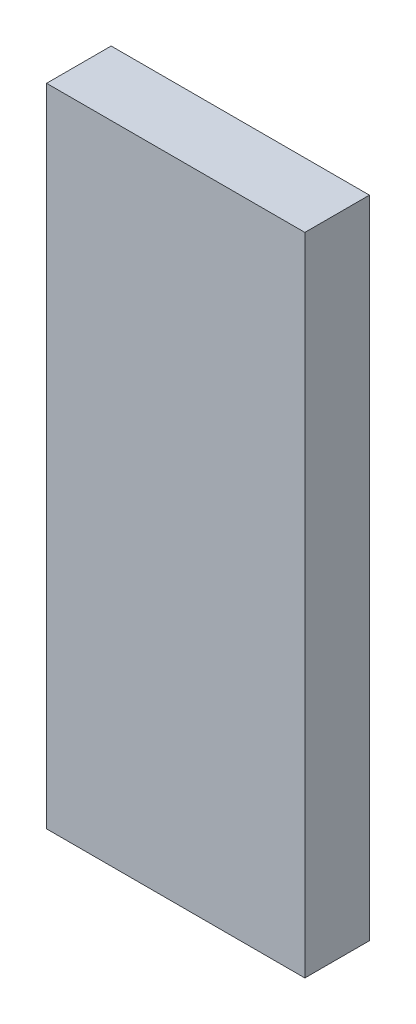
from build123d import *

# Parameters (mm, degrees)
SKETCH1_W           = 200
SKETCH1_H           = 500
BOSS_EXTRUDE1_DEPTH = 50
SKETCH2_W           = 41.83207194
SKETCH2_H           = 10.827124502
CUT_EXTRUDE1_DEPTH  = 3


with BuildPart() as part:
    # Sketch1 → Boss-Extrude1 (new body)
    with BuildSketch(Plane.XY):
        Rectangle(SKETCH1_W, SKETCH1_H)
    extrude(amount=BOSS_EXTRUDE1_DEPTH)

    # Sketch2 → Cut-Extrude1 (cut)
    # profile 1 of 38: a face of its own
    with BuildSketch(Plane(origin=(0, 0, 0), x_dir=(-1, 0, 0), z_dir=(0, 0, -1))):
        Polygon((-36, -160.684370452), (-77.83207194, -160.684370452), (-77.83207194, -170.035068886), (-58.992260129, -170.035068886), (-77.83207194, -175.94077316), (-77.83207194, -185.291471594), (-36, -185.291471594), (-36, -175.94077316), (-55.016675351, -175.94077316), (-36, -170.035068886), align=None)
    # profile 2 of 38: a face of its own
    with BuildSketch(Plane(origin=(0, 0, 0), x_dir=(-1, 0, 0), z_dir=(0, 0, -1))):
        with BuildLine():
            Line((-62.575669233, -141.490831562), (-62.575669233, -130.66370706))
            Line((-62.575669233, -130.66370706), (-64.382753223, -130.66370706))
            add(Edge.make_bspline(
                [(-78.816355986, -143.828506171), (-78.815390768, -143.053207486), (-78.762380154, -141.914159008), (-78.552655542, -140.439162032), (-78.338368563, -139.406127009), (-78.062071507, -138.425106457), (-77.732091323, -137.492053465), (-77.33202692, -136.615303941), (-76.870015099, -135.796566188), (-76.371670248, -135.037875276), (-75.846980946, -134.340009898), (-75.297108271, -133.71253621), (-74.724775023, -133.153238749), (-74.13100355, -132.665936084), (-73.51349738, -132.248359585), (-72.872834866, -131.898874566), (-72.197760824, -131.621060641), (-71.47606874, -131.384321554), (-70.684094287, -131.200999418), (-69.820650786, -131.028988802), (-68.881600378, -130.890290384), (-67.86470462, -130.796701242), (-66.358483513, -130.687179128), (-65.18777909, -130.665151734), (-64.382753223, -130.66370706)],
                knots=[0, 0, 0, 0, 0.102699209, 0.150706002, 0.197175983, 0.242312582, 0.285583989, 0.328118116, 0.369761069, 0.409963713, 0.448254962, 0.485298044, 0.520346291, 0.554118652, 0.586883069, 0.618932772, 0.650580866, 0.683429582, 0.719409064, 0.758155038, 0.800017402, 0.845042809, 0.893365409, 1, 1, 1, 1], degree=3))
            add(Edge.make_bspline(
                [(-62.798671087, -156.255092247), (-63.734288232, -156.25612913), (-65.085988889, -156.244472784), (-66.818314611, -156.167044529), (-67.964676547, -156.101156763), (-69.008715289, -156.01129268), (-69.9493525, -155.89412688), (-70.786895186, -155.768307325), (-71.538266964, -155.613542001), (-72.232793085, -155.415575672), (-72.892444903, -155.130264692), (-73.54328054, -154.778917234), (-74.16785202, -154.330841066), (-74.799738435, -153.836618767), (-75.396530934, -153.241598451), (-75.989299488, -152.581092647), (-76.564221944, -151.848660448), (-77.093341874, -151.04602515), (-77.554581786, -150.180521195), (-77.952055636, -149.261614037), (-78.260348314, -148.280012447), (-78.518739044, -147.249145173), (-78.75796725, -145.762894756), (-78.806567668, -144.611346654), (-78.816355986, -143.828506171)],
                knots=[0, 0, 0, 0, 0.118707986, 0.171437033, 0.219977834, 0.26437475, 0.304345998, 0.340219613, 0.371789318, 0.40162843, 0.431645973, 0.462789075, 0.495263597, 0.529035852, 0.564449624, 0.601986961, 0.641602123, 0.682459069, 0.723776701, 0.765877736, 0.809274946, 0.854151587, 0.900608607, 1, 1, 1, 1], degree=3))
            Line((-62.798671087, -156.255092247), (-50.310567257, -156.255092247))
            add(Edge.make_bspline(
                [(-35.015715954, -145.304932239), (-35.019625363, -146.222543319), (-35.172734617, -147.603480511), (-35.744254539, -149.355349204), (-36.326418745, -150.598960178), (-37.029187722, -151.74427404), (-37.818499678, -152.76593481), (-38.694788906, -153.637448193), (-39.645222336, -154.356370538), (-40.649103008, -154.924584065), (-41.671299306, -155.399618243), (-42.726946741, -155.733576012), (-43.635663664, -155.922759812), (-44.403571726, -156.023242465), (-45.047752638, -156.081565837), (-45.757841415, -156.135349609), (-46.536992434, -156.183453637), (-47.385803386, -156.210402177), (-48.651940122, -156.243221298), (-49.633845456, -156.252417941), (-50.310567257, -156.255092247)],
                knots=[0, 0, 0, 0, 0.127853296, 0.191619234, 0.255803248, 0.318602118, 0.378354894, 0.435134858, 0.490166308, 0.543728174, 0.595474673, 0.646827093, 0.697501667, 0.724504606, 0.754618249, 0.787546193, 0.82365471, 0.863294202, 0.905776522, 1, 1, 1, 1], degree=3))
            add(Edge.make_bspline(
                [(-39.01436989, -138.291908414), (-38.39732499, -138.658307521), (-37.528475472, -139.284624174), (-36.592017338, -140.328398123), (-36.01577019, -141.172006215), (-35.569258863, -142.095388581), (-35.119120415, -143.459378431), (-35.016366558, -144.559533197), (-35.015715954, -145.304932239)],
                knots=[0, 0, 0, 0, 0.254086595, 0.3746835, 0.494032044, 0.61395679, 0.735994537, 1, 1, 1, 1], degree=3))
            Line((-39.01436989, -138.291908414), (-36, -137.315314087))
            Line((-36, -137.315314087), (-36, -130.66370706))
            Line((-36, -130.66370706), (-58.63853305, -130.66370706))
            Line((-58.63853305, -130.66370706), (-58.63853305, -143.459399653))
            Line((-58.63853305, -143.459399653), (-52.240686753, -143.459399653))
            Line((-52.240686753, -143.459399653), (-52.240686753, -140.998689539))
            Line((-52.240686753, -140.998689539), (-47.057816075, -140.998689539))
            add(Edge.make_bspline(
                [(-41.905704274, -143.344053867), (-41.91662453, -142.958540582), (-41.997811279, -142.357589914), (-42.485296623, -141.762700118), (-42.882774495, -141.512472113), (-43.268736822, -141.36314744), (-43.62783687, -141.267989917), (-44.048790591, -141.182423043), (-44.529258609, -141.116529765), (-45.073005596, -141.062404845), (-45.921502809, -141.010816222), (-46.591172319, -140.998725276), (-47.057816075, -140.998689539)],
                knots=[0, 0, 0, 0, 0.184659092, 0.266523499, 0.352360151, 0.40136325, 0.459855901, 0.525958384, 0.60229324, 0.686676074, 0.781625113, 1, 1, 1, 1], degree=3))
            add(Edge.make_bspline(
                [(-46.596432929, -145.427967745), (-46.158399163, -145.418212795), (-45.53151266, -145.428713547), (-44.74013363, -145.36962006), (-44.237709065, -145.323564922), (-43.795364492, -145.274663752), (-43.412923893, -145.204238228), (-43.091906994, -145.125187093), (-42.754701387, -144.993631979), (-42.406685942, -144.77617296), (-41.986802813, -144.23361332), (-41.896126667, -143.700781748), (-41.905704274, -143.344053867)],
                knots=[0, 0, 0, 0, 0.225316357, 0.321712486, 0.407708077, 0.484672241, 0.550305097, 0.607502471, 0.6542287, 0.73607783, 0.814880436, 1, 1, 1, 1], degree=3))
            Line((-46.596432929, -145.427967745), (-67.07415491, -145.427967745))
            add(Edge.make_bspline(
                [(-71.926367666, -143.49015853), (-71.941652795, -143.815659714), (-71.847499586, -144.289804844), (-71.499057861, -144.799668084), (-71.190736618, -145.016690896), (-70.87468045, -145.131694457), (-70.558458949, -145.215515816), (-70.164608112, -145.281958874), (-69.694433876, -145.33203791), (-69.148548647, -145.37983651), (-68.266539992, -145.420725896), (-67.56629772, -145.423025939), (-67.07415491, -145.427967745)],
                knots=[0, 0, 0, 0, 0.164556384, 0.236222909, 0.307889435, 0.351033273, 0.406128633, 0.47334376, 0.553034584, 0.645513178, 0.750770316, 1, 1, 1, 1], degree=3))
            add(Edge.make_bspline(
                [(-66.435908224, -141.490831562), (-66.987055462, -141.492706565), (-67.771598556, -141.503346578), (-68.761144905, -141.532738803), (-69.37701757, -141.567947233), (-69.906779148, -141.626880609), (-70.352185017, -141.67298022), (-70.712732069, -141.741779626), (-71.068723713, -141.84505294), (-71.429926785, -142.041411629), (-71.852226945, -142.58626486), (-71.933746568, -143.126777808), (-71.926367666, -143.49015853)],
                knots=[0, 0, 0, 0, 0.249727908, 0.3554723, 0.448565218, 0.529112821, 0.596962566, 0.651399682, 0.695118157, 0.76484058, 0.833402264, 1, 1, 1, 1], degree=3))
            Line((-66.435908224, -141.490831562), (-62.575669233, -141.490831562))
        make_face()
    # profile 3 of 38: a face of its own
    with BuildSketch(Plane(origin=(0, 0, 0), x_dir=(-1, 0, 0), z_dir=(0, 0, -1))):
        with BuildLine():
            Line((-49.803045796, -101.627327713), (-77.83207194, -101.627327713))
            Line((-77.83207194, -101.627327713), (-77.83207194, -112.454452215))
            Line((-77.83207194, -112.454452215), (-46.750227311, -112.454452215))
            add(Edge.make_bspline(
                [(-41.905704274, -114.246156767), (-41.919360467, -113.936437027), (-41.961463458, -113.436739219), (-42.373805834, -112.978828063), (-42.694503862, -112.793557489), (-43.020297178, -112.69877147), (-43.341275765, -112.630207659), (-43.735122294, -112.580797581), (-44.199178601, -112.534689888), (-44.734986741, -112.495473055), (-45.594014476, -112.467831542), (-46.27335343, -112.455761867), (-46.750227311, -112.454452215)],
                knots=[0, 0, 0, 0, 0.166051182, 0.236158967, 0.309457565, 0.353679748, 0.41033696, 0.478238553, 0.557775507, 0.650343349, 0.75462239, 1, 1, 1, 1], degree=3))
            add(Edge.make_bspline(
                [(-46.204257255, -115.899446375), (-45.786206535, -115.899223639), (-45.18919433, -115.884231003), (-44.43477743, -115.860464596), (-43.961675591, -115.813534529), (-43.548661612, -115.788106997), (-43.202163803, -115.717898989), (-42.913872764, -115.664235861), (-42.621697356, -115.564765373), (-42.325760507, -115.391374017), (-41.978350338, -114.957281291), (-41.896668799, -114.531245399), (-41.905704274, -114.246156767)],
                knots=[0, 0, 0, 0, 0.24140153, 0.345145832, 0.435771585, 0.51607153, 0.583747885, 0.639799849, 0.685221462, 0.761660699, 0.834275521, 1, 1, 1, 1], degree=3))
            Line((-46.204257255, -115.899446375), (-77.83207194, -115.899446375))
            Line((-77.83207194, -115.899446375), (-77.83207194, -126.726570877))
            Line((-77.83207194, -126.726570877), (-53.017348383, -126.726570877))
            add(Edge.make_bspline(
                [(-35.015715954, -113.769394183), (-35.017955789, -114.960817349), (-35.144901679, -116.71275575), (-35.679839226, -118.932360217), (-36.224346147, -120.428707339), (-36.888995393, -121.779242863), (-37.648615399, -122.966900077), (-38.505836879, -123.977487535), (-39.46711772, -124.785555705), (-40.484508633, -125.422514384), (-41.524823169, -125.934014123), (-42.603888614, -126.278043826), (-43.545423757, -126.458857102), (-44.386252073, -126.533088504), (-45.168227045, -126.585627643), (-46.103850344, -126.633482508), (-47.191112654, -126.657539443), (-48.431573871, -126.691543121), (-50.389887037, -126.724875132), (-51.935705102, -126.715990637), (-53.017348383, -126.726570877)],
                knots=[0, 0, 0, 0, 0.13652337, 0.199942734, 0.260843962, 0.318459923, 0.371940148, 0.421882968, 0.469566562, 0.515077556, 0.559048619, 0.601924893, 0.644343772, 0.668522292, 0.698526299, 0.734079396, 0.775768193, 0.823030907, 0.87615567, 1, 1, 1, 1], degree=3))
            add(Edge.make_bspline(
                [(-49.803045796, -101.627327713), (-49.067375253, -101.630172798), (-48.008575114, -101.638802395), (-46.657834889, -101.67157044), (-45.778283078, -101.698886314), (-44.986275467, -101.746622032), (-44.28124725, -101.799590904), (-43.665000078, -101.857312403), (-42.957993609, -101.95998657), (-42.116964618, -102.154375058), (-41.126600102, -102.549465884), (-40.124725496, -103.09367605), (-39.127726587, -103.778479674), (-38.177672417, -104.599064544), (-37.335345151, -105.557672406), (-36.619267312, -106.641821932), (-36.037828996, -107.849169338), (-35.576780876, -109.169776751), (-35.120630054, -111.141565945), (-35.026747206, -112.702855485), (-35.015715954, -113.769394183)],
                knots=[0, 0, 0, 0, 0.098873815, 0.142291433, 0.181587078, 0.217129353, 0.24891373, 0.276610113, 0.300287149, 0.344905817, 0.39224485, 0.443107693, 0.4978594, 0.554506245, 0.611379937, 0.668801841, 0.728579952, 0.791008118, 0.856437006, 1, 1, 1, 1], degree=3))
        make_face()
    # profile 4 of 38: a face of its own
    with BuildSketch(Plane(origin=(0, 0, 0), x_dir=(-1, 0, 0), z_dir=(0, 0, -1))):
        with BuildLine():
            Line((-51.141056921, -81.9416468), (-77.83207194, -74.067374435))
            Line((-77.83207194, -74.067374435), (-77.83207194, -83.787179386))
            add(Edge.make_bspline(
                [(-60.883931029, -87.162966074), (-62.05591649, -86.871798008), (-63.880576924, -86.459171361), (-66.392571864, -85.921437591), (-68.454031277, -85.506119482), (-70.630808771, -85.085979101), (-73.768371952, -84.495768482), (-76.181430451, -84.065243391), (-77.83207194, -83.787179386)],
                knots=[0, 0, 0, 0, 0.20958667, 0.324680331, 0.445872287, 0.574569946, 0.709469173, 1, 1, 1, 1], degree=3))
            add(Edge.make_bspline(
                [(-77.83207194, -90.431096694), (-76.812887604, -90.246065785), (-75.314488969, -89.990398955), (-73.363971398, -89.643709752), (-72.000278304, -89.397859237), (-70.706652724, -89.157643103), (-69.477053805, -88.939176411), (-68.318041309, -88.709968738), (-67.221821031, -88.508742536), (-66.198094262, -88.303287118), (-65.239826772, -88.124528186), (-64.35252493, -87.934498591), (-63.524966336, -87.770581065), (-62.77032414, -87.599337669), (-61.895845415, -87.401129263), (-61.27264181, -87.269928978), (-60.883931029, -87.162966074)],
                knots=[0, 0, 0, 0, 0.180007967, 0.264154401, 0.344276098, 0.420812096, 0.492806059, 0.561297289, 0.626121216, 0.68648665, 0.742746741, 0.795512556, 0.844172061, 0.889346733, 0.929979896, 1, 1, 1, 1], degree=3))
            Line((-77.83207194, -90.431096694), (-77.83207194, -100.150901645))
            Line((-77.83207194, -100.150901645), (-51.141056921, -92.27662928))
            Line((-51.141056921, -92.27662928), (-36, -92.27662928))
            Line((-36, -92.27662928), (-36, -81.9416468))
            Line((-36, -81.9416468), (-51.141056921, -81.9416468))
        make_face()
    # profile 5 of 38: a face of its own
    with BuildSketch(Plane(origin=(0, 0, 0), x_dir=(-1, 0, 0), z_dir=(0, 0, -1))):
        Polygon((-77.83207194, -53.889551499), (-77.83207194, -72.590948367), (-36, -72.590948367), (-36, -53.397409476), (-44.366414388, -53.397409476), (-44.366414388, -61.763823865), (-53.717112822, -61.763823865), (-53.717112822, -54.381693522), (-61.591385187, -54.381693522), (-61.591385187, -61.763823865), (-69.465657552, -61.763823865), (-69.465657552, -53.889551499), align=None)
    # profile 6 of 38: a face of its own
    with BuildSketch(Plane(origin=(0, 0, 0), x_dir=(-1, 0, 0), z_dir=(0, 0, -1))):
        Polygon((-36, -25.837456198), (-77.83207194, -25.837456198), (-77.83207194, -35.188154632), (-58.992260129, -35.188154632), (-77.83207194, -41.093858906), (-77.83207194, -50.44455734), (-36, -50.44455734), (-36, -41.093858906), (-55.016675351, -41.093858906), (-36, -35.188154632), align=None)
    # profile 7 of 38: a face of its own
    with BuildSketch(Plane(origin=(0, 0, 0), x_dir=(-1, 0, 0), z_dir=(0, 0, -1))):
        with BuildLine():
            Line((-77.83207194, -0.961214888), (-77.83207194, -12.057479559))
            Line((-77.83207194, -12.057479559), (-36, -12.057479559))
            Line((-36, -12.057479559), (-36, 0.661315843))
            add(Edge.make_bspline(
                [(-45.950496524, 13.533905628), (-45.281188657, 13.533390337), (-44.310301341, 13.509086707), (-43.062410772, 13.403239312), (-42.230436943, 13.299420544), (-41.468133663, 13.159799231), (-40.776561496, 12.993237345), (-40.150979189, 12.79498657), (-39.423465287, 12.493431428), (-38.621502499, 12.028594316), (-37.817499297, 11.305630809), (-37.184898564, 10.432339536), (-36.792253548, 9.581771751), (-36.566448765, 8.78277087), (-36.413882528, 8.034846889), (-36.288932137, 7.148589677), (-36.181810289, 6.120035159), (-36.100785504, 4.955601597), (-36.011784788, 3.120624689), (-36.011815039, 1.673655329), (-36, 0.661315843)],
                knots=[0, 0, 0, 0, 0.102268902, 0.148252963, 0.191287831, 0.230306444, 0.266587991, 0.299901488, 0.330446165, 0.386794172, 0.440584461, 0.494394702, 0.550463064, 0.582683787, 0.621084401, 0.666995037, 0.719365379, 0.779044003, 0.845298245, 1, 1, 1, 1], degree=3))
            Line((-45.950496524, 13.533905628), (-49.879942987, 13.533905628))
            add(Edge.make_bspline(
                [(-58.884604061, 7.22833596), (-58.753165372, 7.801482905), (-58.517706765, 8.626253206), (-58.093374263, 9.644722058), (-57.75826847, 10.312496687), (-57.377264033, 10.899087597), (-56.972085953, 11.420546977), (-56.523151103, 11.863965668), (-56.026625223, 12.232764194), (-55.478781794, 12.540475866), (-54.87566264, 12.813275845), (-54.203591963, 13.031000431), (-53.468914609, 13.215833585), (-52.667746915, 13.362288918), (-51.465027254, 13.494391525), (-50.526661247, 13.531897244), (-49.879942987, 13.533905628)],
                knots=[0, 0, 0, 0, 0.144042592, 0.209308729, 0.269932359, 0.32668049, 0.38029181, 0.431325131, 0.480651429, 0.531246854, 0.584898562, 0.642449522, 0.703940699, 0.770287073, 0.84166898, 1, 1, 1, 1], degree=3))
            add(Edge.make_bspline(
                [(-66.105250302, 13.041763605), (-65.548063377, 13.050588403), (-64.74513108, 13.009255354), (-63.726437289, 12.881127281), (-63.060340688, 12.765911598), (-62.466362197, 12.591000146), (-61.933653738, 12.399352506), (-61.4724867, 12.156319629), (-61.067833319, 11.87595319), (-60.71509648, 11.530163149), (-60.379403556, 11.130888655), (-60.087277373, 10.647142397), (-59.798916836, 10.104490549), (-59.528279562, 9.489553159), (-59.208977212, 8.525847548), (-58.994656416, 7.76448583), (-58.884604061, 7.22833596)],
                knots=[0, 0, 0, 0, 0.159635238, 0.229971647, 0.294226611, 0.35304997, 0.407212491, 0.456168779, 0.502023537, 0.547742778, 0.59730697, 0.651109669, 0.709268858, 0.77341036, 0.843331301, 1, 1, 1, 1], degree=3))
            add(Edge.make_bspline(
                [(-77.83207194, -0.961214888), (-77.8225621, -0.138420889), (-77.815524423, 1.057158525), (-77.733111747, 2.5979489), (-77.637791915, 3.63321035), (-77.532868813, 4.590220723), (-77.405624572, 5.468681797), (-77.243997475, 6.266414188), (-77.060106845, 6.994738684), (-76.835869162, 7.667620737), (-76.558704233, 8.297315755), (-76.232943667, 8.893057814), (-75.863253322, 9.458786578), (-75.437691703, 9.990900208), (-74.961569934, 10.489970127), (-74.433181592, 10.954302112), (-73.853173272, 11.389273415), (-73.201684637, 11.788639162), (-72.456864128, 12.124806052), (-71.618608906, 12.406664335), (-70.693955945, 12.644457026), (-69.674796889, 12.816943271), (-68.14055389, 12.995073411), (-66.936996917, 13.050927995), (-66.105250302, 13.041763605)],
                knots=[0, 0, 0, 0, 0.114375021, 0.166108066, 0.214389793, 0.258843936, 0.299904114, 0.337700596, 0.371916123, 0.404247528, 0.436150213, 0.467395744, 0.49851919, 0.529953016, 0.56195301, 0.594258892, 0.62760283, 0.662610335, 0.70023013, 0.740899013, 0.785395956, 0.832776928, 0.884431414, 1, 1, 1, 1], degree=3))
        make_face()
        with BuildLine():
            Line((-61.591385187, -1.230355057), (-70.942083621, -1.230355057))
            add(Edge.make_bspline(
                [(-66.943429685, 2.706781126), (-67.504090599, 2.71308403), (-68.275968404, 2.673633731), (-69.203991324, 2.512476119), (-69.693459737, 2.331008494), (-70.06788504, 2.109704172), (-70.359699797, 1.859767276), (-70.583789818, 1.580495658), (-70.730295957, 1.243720836), (-70.818850446, 0.821344812), (-70.916381949, -0.009445967), (-70.933315215, -0.712462676), (-70.942083621, -1.230355057)],
                knots=[0, 0, 0, 0, 0.246773781, 0.340005048, 0.413618877, 0.475394665, 0.530632455, 0.582131195, 0.631661098, 0.690822181, 0.771635832, 1, 1, 1, 1], degree=3))
            add(Edge.make_bspline(
                [(-61.614454344, -0.030758876), (-61.607738494, 0.454986463), (-61.666332597, 1.137776967), (-62.020074865, 1.897304632), (-62.338610711, 2.205643847), (-62.673681188, 2.352182629), (-63.011133956, 2.453283122), (-63.443527717, 2.52023961), (-63.965929847, 2.592311593), (-64.579485243, 2.642470354), (-65.581509868, 2.696871488), (-66.379496339, 2.705884026), (-66.943429685, 2.706781126)],
                knots=[0, 0, 0, 0, 0.207117208, 0.283923184, 0.350830951, 0.389245474, 0.438074134, 0.499906873, 0.574464838, 0.661754019, 0.760816726, 1, 1, 1, 1], degree=3))
            add(Edge.make_bspline(
                [(-61.591385187, -1.230355057), (-61.607444627, -0.630641574), (-61.614454344, -0.030758876)],
                knots=[0, 0, 0, 1, 1, 1], degree=2))
        make_face(mode=Mode.SUBTRACT)
        with BuildLine():
            Line((-42.88998832, -1.230355057), (-55.19353889, -1.230355057))
            add(Edge.make_bspline(
                [(-51.094918606, 2.706781126), (-51.517622248, 2.706186401), (-52.122812535, 2.700328478), (-52.876816255, 2.617193297), (-53.344537989, 2.566050585), (-53.736400382, 2.469896278), (-54.064804785, 2.368185681), (-54.321938226, 2.237939263), (-54.524231387, 2.085671955), (-54.671156664, 1.880632275), (-54.789870384, 1.624119951), (-54.897313381, 1.304231779), (-54.986104869, 0.920229671), (-55.061893826, 0.473362749), (-55.14760538, -0.248968936), (-55.178820078, -0.824851797), (-55.19353889, -1.230355057)],
                knots=[0, 0, 0, 0, 0.18234372, 0.260036521, 0.32688627, 0.384748242, 0.433641625, 0.474638114, 0.508443963, 0.541575631, 0.582078258, 0.629925201, 0.686712704, 0.751712351, 0.82513553, 1, 1, 1, 1], degree=3))
            Line((-51.094918606, 2.706781126), (-46.988608603, 2.706781126))
            add(Edge.make_bspline(
                [(-42.88998832, -1.230355057), (-42.907715477, -0.845759613), (-42.930616585, -0.293920004), (-43.029806265, 0.396592531), (-43.11051817, 0.832138639), (-43.219097918, 1.209499317), (-43.339127875, 1.532666028), (-43.474664052, 1.801101615), (-43.644230382, 2.014321276), (-43.859135525, 2.182264982), (-44.121719311, 2.33013621), (-44.452186206, 2.43860153), (-44.839015356, 2.541288153), (-45.289908, 2.613782785), (-46.012681815, 2.686260273), (-46.585474828, 2.716273499), (-46.988608603, 2.706781126)],
                knots=[0, 0, 0, 0, 0.168583806, 0.241049478, 0.305039014, 0.362178465, 0.412572109, 0.455707222, 0.493180931, 0.530654639, 0.574325613, 0.624331078, 0.682257189, 0.749354057, 0.823771208, 1, 1, 1, 1], degree=3))
        make_face(mode=Mode.SUBTRACT)
    # profile 8 of 38: a face of its own
    with BuildSketch(Plane(origin=(0, 0, 0), x_dir=(-1, 0, 0), z_dir=(0, 0, -1))):
        Polygon((-36, 42.570284974), (-77.83207194, 36.049403172), (-77.83207194, 20.05478743), (-36, 14.518189673), (-36, 25.714420693), (-43.382130342, 26.360357098), (-43.382130342, 30.751186707), (-36, 31.374053955), align=None)
        with BuildLine():
            Line((-50.764260685, 30.243665246), (-50.764260685, 26.375736536))
            add(Edge.make_bspline(
                [(-68.973515529, 28.544237324), (-67.049890213, 28.323478632), (-64.267751775, 27.977506853), (-60.692160861, 27.550803769), (-58.312411666, 27.277864941), (-56.139223518, 27.015228907), (-53.646127351, 26.710069678), (-51.876446413, 26.508647802), (-50.764260685, 26.375736536)],
                knots=[0, 0, 0, 0, 0.316756927, 0.458647951, 0.58909848, 0.708623297, 0.816756929, 1, 1, 1, 1], degree=3))
            add(Edge.make_bspline(
                [(-50.764260685, 30.243665246), (-52.060891059, 30.119237327), (-54.061068632, 29.941214562), (-56.8004866, 29.677590158), (-59.020327998, 29.470752512), (-61.353288458, 29.25730303), (-64.682253979, 28.939846186), (-67.235576039, 28.70503229), (-68.973515529, 28.544237324)],
                knots=[0, 0, 0, 0, 0.213673666, 0.329399953, 0.451444933, 0.579390146, 0.713693278, 1, 1, 1, 1], degree=3))
        make_face(mode=Mode.SUBTRACT)
    # profile 9 of 38: a face of its own
    with BuildSketch(Plane(origin=(0, 0, 0), x_dir=(-1, 0, 0), z_dir=(0, 0, -1))):
        with BuildLine():
            Line((-60.514824512, 44.538853066), (-53.317247428, 44.538853066))
            add(Edge.make_bspline(
                [(-35.015715954, 57.088474648), (-35.016573642, 56.022563397), (-35.138851643, 54.452598571), (-35.609013409, 52.449768545), (-36.093863502, 51.073635509), (-36.698605001, 49.793981953), (-37.476914954, 48.655790934), (-38.366957751, 47.624782117), (-39.410835642, 46.757722403), (-40.533311208, 46.027595316), (-41.720970189, 45.46118911), (-42.955819077, 45.055528881), (-44.039713531, 44.85598559), (-44.983523181, 44.772100298), (-45.814108662, 44.710072454), (-46.76786331, 44.65821037), (-47.841808195, 44.610339478), (-49.039116702, 44.583046946), (-50.876894257, 44.550452976), (-52.317568163, 44.541570128), (-53.317247428, 44.538853066)],
                knots=[0, 0, 0, 0, 0.123186704, 0.181008099, 0.237202779, 0.291504649, 0.343987522, 0.396025725, 0.44835046, 0.500180972, 0.550381919, 0.599920811, 0.649928359, 0.677302448, 0.709372201, 0.746150888, 0.787647262, 0.833562824, 0.884505076, 1, 1, 1, 1], degree=3))
            add(Edge.make_bspline(
                [(-53.317247428, 69.63809623), (-52.338107064, 69.628656354), (-50.928209221, 69.634302378), (-49.126067394, 69.604994886), (-47.949832123, 69.5611807), (-46.885568445, 69.529025323), (-45.937188426, 69.473834494), (-45.103947222, 69.412797345), (-44.15381331, 69.32638452), (-43.059260512, 69.146938179), (-41.815978706, 68.756064182), (-40.633374678, 68.205773866), (-39.517328042, 67.503557174), (-38.483587915, 66.663547311), (-37.577315657, 65.664916324), (-36.794139044, 64.533540641), (-36.152167395, 63.263271336), (-35.634470741, 61.879824392), (-35.14527432, 59.820763971), (-35.006728776, 58.199300842), (-35.015715954, 57.088474648)],
                knots=[0, 0, 0, 0, 0.11310055, 0.162848353, 0.208171349, 0.249055911, 0.285827126, 0.317890363, 0.34555357, 0.396029061, 0.44565955, 0.495598169, 0.546282494, 0.597611279, 0.648954578, 0.701516088, 0.756070273, 0.812935115, 0.871746706, 1, 1, 1, 1], degree=3))
            Line((-53.317247428, 69.63809623), (-60.514824512, 69.63809623))
            add(Edge.make_bspline(
                [(-78.816355986, 57.088474648), (-78.817951987, 58.15487634), (-78.688860198, 59.720343533), (-78.230971682, 61.722465354), (-77.747849115, 63.098073772), (-77.12923013, 64.373878902), (-76.360891547, 65.520381091), (-75.461736232, 66.544064866), (-74.422038632, 67.412606362), (-73.296535513, 68.139694557), (-72.113282073, 68.717877286), (-70.878245723, 69.119163261), (-69.797727258, 69.322838085), (-68.853280579, 69.402409314), (-68.021218046, 69.479878409), (-67.063824061, 69.51437968), (-65.990353813, 69.56860775), (-64.79282519, 69.590549304), (-62.955458778, 69.645755829), (-61.51431234, 69.622223114), (-60.514824512, 69.63809623)],
                knots=[0, 0, 0, 0, 0.123193932, 0.180662712, 0.236860689, 0.291295599, 0.344027448, 0.395846617, 0.448174423, 0.500007975, 0.550340105, 0.599881904, 0.6496013, 0.676976995, 0.709367001, 0.746132344, 0.787631153, 0.833549409, 0.884500674, 1, 1, 1, 1], degree=3))
            add(Edge.make_bspline(
                [(-60.514824512, 44.538853066), (-61.491396751, 44.548267677), (-62.901308117, 44.54263338), (-64.703428414, 44.57211716), (-65.882289595, 44.614845147), (-66.94365119, 44.650807408), (-67.892556446, 44.693599757), (-68.725503773, 44.756895636), (-69.678965509, 44.841326925), (-70.7718, 45.032948881), (-72.016498912, 45.419673825), (-73.199618487, 45.973905156), (-74.32057933, 46.668634865), (-75.351595565, 47.516332478), (-76.250098393, 48.518266567), (-77.039898863, 49.64429216), (-77.68202795, 50.912216844), (-78.186241857, 52.302306389), (-78.696163627, 54.355748697), (-78.805085839, 55.982811561), (-78.816355986, 57.088474648)],
                knots=[0, 0, 0, 0, 0.112808074, 0.162853494, 0.208177932, 0.249063796, 0.285524951, 0.317884488, 0.345548575, 0.39607688, 0.445708948, 0.495649157, 0.546586122, 0.597688037, 0.649251897, 0.701571856, 0.756127778, 0.812891824, 0.872063415, 1, 1, 1, 1], degree=3))
        make_face()
        with BuildLine():
            Line((-47.36540484, 55.365977568), (-67.289467045, 55.365977568))
            add(Edge.make_bspline(
                [(-71.926367666, 57.142302681), (-71.939186868, 56.878671644), (-71.847828531, 56.490394115), (-71.55869417, 56.058881022), (-71.306919503, 55.83693195), (-71.030469694, 55.694812738), (-70.733179295, 55.608633859), (-70.357445251, 55.53391665), (-69.899660214, 55.476714407), (-69.364340286, 55.418961524), (-68.484087303, 55.38559824), (-67.784591676, 55.361013737), (-67.289467045, 55.365977568)],
                knots=[0, 0, 0, 0, 0.141229944, 0.207870292, 0.277367941, 0.319365436, 0.37439268, 0.443449943, 0.525666756, 0.622809696, 0.733417226, 1, 1, 1, 1], degree=3))
            add(Edge.make_bspline(
                [(-67.289467045, 58.810971728), (-67.740719081, 58.809556151), (-68.38415763, 58.797391279), (-69.197101724, 58.770201084), (-69.70719626, 58.730047699), (-70.150815729, 58.684765772), (-70.529405587, 58.635536329), (-70.837441257, 58.566151494), (-71.151457747, 58.47068403), (-71.461059868, 58.295110832), (-71.856484318, 57.879939475), (-71.91798631, 57.425390205), (-71.926367666, 57.142302681)],
                knots=[0, 0, 0, 0, 0.245381507, 0.350013726, 0.44228014, 0.523562531, 0.592561096, 0.649714338, 0.695120491, 0.770678918, 0.840725622, 1, 1, 1, 1], degree=3))
            Line((-67.289467045, 58.810971728), (-47.680683323, 58.810971728))
            add(Edge.make_bspline(
                [(-41.905704274, 57.06540549), (-41.909233617, 57.376064161), (-41.991223421, 57.883450305), (-42.46845597, 58.318807936), (-42.844415463, 58.48679985), (-43.22485417, 58.584577113), (-43.606770618, 58.639161545), (-44.073319054, 58.693759266), (-44.627169657, 58.740235715), (-45.268514845, 58.766768134), (-46.296246168, 58.800383272), (-47.109063884, 58.80793152), (-47.680683323, 58.810971728)],
                knots=[0, 0, 0, 0, 0.144508876, 0.209626381, 0.282206802, 0.327424738, 0.385694884, 0.455209163, 0.538351522, 0.635125416, 0.743352513, 1, 1, 1, 1], degree=3))
            add(Edge.make_bspline(
                [(-47.36540484, 55.365977568), (-46.804066483, 55.375440259), (-46.006740546, 55.36959669), (-45.004077891, 55.398135101), (-44.386913817, 55.442351067), (-43.857649481, 55.473080535), (-43.416654075, 55.528617711), (-43.064359817, 55.586855021), (-42.721494889, 55.670047504), (-42.388671212, 55.842684038), (-41.975477584, 56.28325445), (-41.907339629, 56.762874982), (-41.905704274, 57.06540549)],
                knots=[0, 0, 0, 0, 0.263965983, 0.374910105, 0.471520145, 0.554902094, 0.624118814, 0.680393612, 0.722784308, 0.789641701, 0.853612109, 1, 1, 1, 1], degree=3))
        make_face(mode=Mode.SUBTRACT)
    # profile 10 of 38: a face of its own
    with BuildSketch(Plane(origin=(0, 0, 0), x_dir=(-1, 0, 0), z_dir=(0, 0, -1))):
        Polygon((-44.366414388, 93.753055348), (-77.83207194, 93.753055348), (-77.83207194, 82.925930846), (-36, 82.925930846), (-36, 100.643043668), (-44.366414388, 100.643043668), align=None)
    # profile 11 of 38: a face of its own
    with BuildSketch(Plane(origin=(0, 0, 0), x_dir=(-1, 0, 0), z_dir=(0, 0, -1))):
        with BuildLine():
            Line((-60.514824512, 103.103753782), (-53.317247428, 103.103753782))
            add(Edge.make_bspline(
                [(-35.015715954, 115.653375364), (-35.016573642, 114.587464113), (-35.138851643, 113.017499287), (-35.609013409, 111.014669261), (-36.093863502, 109.638536225), (-36.698605001, 108.358882669), (-37.476914954, 107.22069165), (-38.366957751, 106.189682833), (-39.410835642, 105.322623119), (-40.533311208, 104.592496032), (-41.720970189, 104.026089826), (-42.955819077, 103.620429597), (-44.039713531, 103.420886306), (-44.983523181, 103.337001014), (-45.814108662, 103.27497317), (-46.76786331, 103.223111086), (-47.841808195, 103.175240194), (-49.039116702, 103.147947662), (-50.876894257, 103.115353692), (-52.317568163, 103.106470844), (-53.317247428, 103.103753782)],
                knots=[0, 0, 0, 0, 0.123186704, 0.181008099, 0.237202779, 0.291504649, 0.343987522, 0.396025725, 0.44835046, 0.500180972, 0.550381919, 0.599920811, 0.649928359, 0.677302448, 0.709372201, 0.746150888, 0.787647262, 0.833562824, 0.884505076, 1, 1, 1, 1], degree=3))
            add(Edge.make_bspline(
                [(-53.317247428, 128.202996946), (-52.338107064, 128.19355707), (-50.928209221, 128.199203094), (-49.126067394, 128.169895602), (-47.949832123, 128.126081416), (-46.885568445, 128.093926039), (-45.937188426, 128.03873521), (-45.103947222, 127.977698061), (-44.15381331, 127.891285236), (-43.059260512, 127.711838895), (-41.815978706, 127.320964898), (-40.633374678, 126.770674583), (-39.517328042, 126.06845789), (-38.483587915, 125.228448027), (-37.577315657, 124.22981704), (-36.794139044, 123.098441357), (-36.152167395, 121.828172052), (-35.634470741, 120.444725108), (-35.14527432, 118.385664687), (-35.006728776, 116.764201558), (-35.015715954, 115.653375364)],
                knots=[0, 0, 0, 0, 0.11310055, 0.162848353, 0.208171349, 0.249055911, 0.285827126, 0.317890363, 0.34555357, 0.396029061, 0.44565955, 0.495598169, 0.546282494, 0.597611279, 0.648954578, 0.701516088, 0.756070273, 0.812935115, 0.871746706, 1, 1, 1, 1], degree=3))
            Line((-53.317247428, 128.202996946), (-60.514824512, 128.202996946))
            add(Edge.make_bspline(
                [(-78.816355986, 115.653375364), (-78.817951987, 116.719777056), (-78.688860198, 118.285244249), (-78.230971682, 120.28736607), (-77.747849115, 121.662974488), (-77.12923013, 122.938779618), (-76.360891547, 124.085281808), (-75.461736232, 125.108965582), (-74.422038632, 125.977507078), (-73.296535513, 126.704595273), (-72.113282073, 127.282778002), (-70.878245723, 127.684063977), (-69.797727258, 127.887738801), (-68.853280579, 127.96731003), (-68.021218046, 128.044779125), (-67.063824061, 128.079280396), (-65.990353813, 128.133508466), (-64.79282519, 128.15545002), (-62.955458778, 128.210656545), (-61.51431234, 128.18712383), (-60.514824512, 128.202996946)],
                knots=[0, 0, 0, 0, 0.123193932, 0.180662712, 0.236860689, 0.291295599, 0.344027448, 0.395846617, 0.448174423, 0.500007975, 0.550340105, 0.599881904, 0.6496013, 0.676976995, 0.709367001, 0.746132344, 0.787631153, 0.833549409, 0.884500674, 1, 1, 1, 1], degree=3))
            add(Edge.make_bspline(
                [(-60.514824512, 103.103753782), (-61.491396751, 103.113168393), (-62.901308117, 103.107534096), (-64.703428414, 103.137017876), (-65.882289595, 103.179745863), (-66.94365119, 103.215708125), (-67.892556446, 103.258500473), (-68.725503773, 103.321796353), (-69.678965509, 103.406227641), (-70.7718, 103.597849597), (-72.016498912, 103.984574542), (-73.199618487, 104.538805872), (-74.32057933, 105.233535581), (-75.351595565, 106.081233194), (-76.250098393, 107.083167283), (-77.039898863, 108.209192876), (-77.68202795, 109.47711756), (-78.186241857, 110.867207105), (-78.696163627, 112.920649413), (-78.805085839, 114.547712277), (-78.816355986, 115.653375364)],
                knots=[0, 0, 0, 0, 0.112808074, 0.162853494, 0.208177932, 0.249063796, 0.285524951, 0.317884488, 0.345548575, 0.39607688, 0.445708948, 0.495649157, 0.546586122, 0.597688037, 0.649251897, 0.701571856, 0.756127778, 0.812891824, 0.872063415, 1, 1, 1, 1], degree=3))
        make_face()
        with BuildLine():
            Line((-47.36540484, 113.930878284), (-67.289467045, 113.930878284))
            add(Edge.make_bspline(
                [(-71.926367666, 115.707203398), (-71.939186868, 115.44357236), (-71.847828531, 115.055294831), (-71.55869417, 114.623781738), (-71.306919503, 114.401832666), (-71.030469694, 114.259713455), (-70.733179295, 114.173534575), (-70.357445251, 114.098817367), (-69.899660214, 114.041615123), (-69.364340286, 113.98386224), (-68.484087303, 113.950498957), (-67.784591676, 113.925914453), (-67.289467045, 113.930878284)],
                knots=[0, 0, 0, 0, 0.141229944, 0.207870292, 0.277367941, 0.319365436, 0.37439268, 0.443449943, 0.525666756, 0.622809696, 0.733417226, 1, 1, 1, 1], degree=3))
            add(Edge.make_bspline(
                [(-67.289467045, 117.375872444), (-67.740719081, 117.374456867), (-68.38415763, 117.362291996), (-69.197101724, 117.3351018), (-69.70719626, 117.294948415), (-70.150815729, 117.249666489), (-70.529405587, 117.200437045), (-70.837441257, 117.13105221), (-71.151457747, 117.035584746), (-71.461059868, 116.860011549), (-71.856484318, 116.444840191), (-71.91798631, 115.990290921), (-71.926367666, 115.707203398)],
                knots=[0, 0, 0, 0, 0.245381507, 0.350013726, 0.44228014, 0.523562531, 0.592561096, 0.649714338, 0.695120491, 0.770678918, 0.840725622, 1, 1, 1, 1], degree=3))
            Line((-67.289467045, 117.375872444), (-47.680683323, 117.375872444))
            add(Edge.make_bspline(
                [(-41.905704274, 115.630306206), (-41.909233617, 115.940964877), (-41.991223421, 116.448351022), (-42.46845597, 116.883708652), (-42.844415463, 117.051700567), (-43.22485417, 117.14947783), (-43.606770618, 117.204062261), (-44.073319054, 117.258659982), (-44.627169657, 117.305136431), (-45.268514845, 117.33166885), (-46.296246168, 117.365283988), (-47.109063884, 117.372832236), (-47.680683323, 117.375872444)],
                knots=[0, 0, 0, 0, 0.144508876, 0.209626381, 0.282206802, 0.327424738, 0.385694884, 0.455209163, 0.538351522, 0.635125416, 0.743352513, 1, 1, 1, 1], degree=3))
            add(Edge.make_bspline(
                [(-47.36540484, 113.930878284), (-46.804066483, 113.940340975), (-46.006740546, 113.934497406), (-45.004077891, 113.963035817), (-44.386913817, 114.007251783), (-43.857649481, 114.037981251), (-43.416654075, 114.093518427), (-43.064359817, 114.151755737), (-42.721494889, 114.23494822), (-42.388671212, 114.407584755), (-41.975477584, 114.848155167), (-41.907339629, 115.327775698), (-41.905704274, 115.630306206)],
                knots=[0, 0, 0, 0, 0.263965983, 0.374910105, 0.471520145, 0.554902094, 0.624118814, 0.680393612, 0.722784308, 0.789641701, 0.853612109, 1, 1, 1, 1], degree=3))
        make_face(mode=Mode.SUBTRACT)
    # profile 12 of 38: a face of its own
    with BuildSketch(Plane(origin=(0, 0, 0), x_dir=(-1, 0, 0), z_dir=(0, 0, -1))):
        Polygon((-36, 156.74723427), (-77.83207194, 156.74723427), (-77.83207194, 147.396535836), (-58.992260129, 147.396535836), (-77.83207194, 141.490831562), (-77.83207194, 132.140133128), (-36, 132.140133128), (-36, 141.490831562), (-55.016675351, 141.490831562), (-36, 147.396535836), align=None)
    # profile 13 of 38: a face of its own
    with BuildSketch(Plane(origin=(0, 0, 0), x_dir=(-1, 0, 0), z_dir=(0, 0, -1))):
        with BuildLine():
            Line((-62.575669233, 175.94077316), (-62.575669233, 186.767897662))
            Line((-62.575669233, 186.767897662), (-64.382753223, 186.767897662))
            add(Edge.make_bspline(
                [(-78.816355986, 173.603098551), (-78.815390768, 174.378397236), (-78.762380154, 175.517445714), (-78.552655542, 176.99244269), (-78.338368563, 178.025477713), (-78.062071507, 179.006498265), (-77.732091323, 179.939551257), (-77.33202692, 180.816300781), (-76.870015099, 181.635038534), (-76.371670248, 182.393729446), (-75.846980946, 183.091594824), (-75.297108271, 183.719068512), (-74.724775023, 184.278365973), (-74.13100355, 184.765668638), (-73.51349738, 185.183245137), (-72.872834866, 185.532730156), (-72.197760824, 185.810544081), (-71.47606874, 186.047283168), (-70.684094287, 186.230605304), (-69.820650786, 186.40261592), (-68.881600378, 186.541314338), (-67.86470462, 186.63490348), (-66.358483513, 186.744425594), (-65.18777909, 186.766452988), (-64.382753223, 186.767897662)],
                knots=[0, 0, 0, 0, 0.102699209, 0.150706002, 0.197175983, 0.242312582, 0.285583989, 0.328118116, 0.369761069, 0.409963713, 0.448254962, 0.485298044, 0.520346291, 0.554118652, 0.586883069, 0.618932772, 0.650580866, 0.683429582, 0.719409064, 0.758155038, 0.800017402, 0.845042809, 0.893365409, 1, 1, 1, 1], degree=3))
            add(Edge.make_bspline(
                [(-62.798671087, 161.176512475), (-63.734288232, 161.175475592), (-65.085988889, 161.187131938), (-66.818314611, 161.264560193), (-67.964676547, 161.330447959), (-69.008715289, 161.420312042), (-69.9493525, 161.537477842), (-70.786895186, 161.663297397), (-71.538266964, 161.818062721), (-72.232793085, 162.01602905), (-72.892444903, 162.30134003), (-73.54328054, 162.652687488), (-74.16785202, 163.100763656), (-74.799738435, 163.594985955), (-75.396530934, 164.190006271), (-75.989299488, 164.850512075), (-76.564221944, 165.582944274), (-77.093341874, 166.385579572), (-77.554581786, 167.251083527), (-77.952055636, 168.169990685), (-78.260348314, 169.151592275), (-78.518739044, 170.182459549), (-78.75796725, 171.668709966), (-78.806567668, 172.820258068), (-78.816355986, 173.603098551)],
                knots=[0, 0, 0, 0, 0.118707986, 0.171437033, 0.219977834, 0.26437475, 0.304345998, 0.340219613, 0.371789318, 0.40162843, 0.431645973, 0.462789075, 0.495263597, 0.529035852, 0.564449624, 0.601986961, 0.641602123, 0.682459069, 0.723776701, 0.765877736, 0.809274946, 0.854151587, 0.900608607, 1, 1, 1, 1], degree=3))
            Line((-62.798671087, 161.176512475), (-50.310567257, 161.176512475))
            add(Edge.make_bspline(
                [(-35.015715954, 172.126672483), (-35.019625363, 171.209061403), (-35.172734617, 169.828124211), (-35.744254539, 168.076255518), (-36.326418745, 166.832644544), (-37.029187722, 165.687330682), (-37.818499678, 164.665669912), (-38.694788906, 163.794156529), (-39.645222336, 163.075234184), (-40.649103008, 162.507020657), (-41.671299306, 162.031986479), (-42.726946741, 161.69802871), (-43.635663664, 161.50884491), (-44.403571726, 161.408362257), (-45.047752638, 161.350038885), (-45.757841415, 161.296255113), (-46.536992434, 161.248151085), (-47.385803386, 161.221202545), (-48.651940122, 161.188383424), (-49.633845456, 161.179186781), (-50.310567257, 161.176512475)],
                knots=[0, 0, 0, 0, 0.127853296, 0.191619234, 0.255803248, 0.318602118, 0.378354894, 0.435134858, 0.490166308, 0.543728174, 0.595474673, 0.646827093, 0.697501667, 0.724504606, 0.754618249, 0.787546193, 0.82365471, 0.863294202, 0.905776522, 1, 1, 1, 1], degree=3))
            add(Edge.make_bspline(
                [(-39.01436989, 179.139696308), (-38.39732499, 178.773297201), (-37.528475472, 178.146980548), (-36.592017338, 177.103206599), (-36.01577019, 176.259598507), (-35.569258863, 175.336216141), (-35.119120415, 173.972226291), (-35.016366558, 172.872071525), (-35.015715954, 172.126672483)],
                knots=[0, 0, 0, 0, 0.254086595, 0.3746835, 0.494032044, 0.61395679, 0.735994537, 1, 1, 1, 1], degree=3))
            Line((-39.01436989, 179.139696308), (-36, 180.116290635))
            Line((-36, 180.116290635), (-36, 186.767897662))
            Line((-36, 186.767897662), (-58.63853305, 186.767897662))
            Line((-58.63853305, 186.767897662), (-58.63853305, 173.972205069))
            Line((-58.63853305, 173.972205069), (-52.240686753, 173.972205069))
            Line((-52.240686753, 173.972205069), (-52.240686753, 176.432915183))
            Line((-52.240686753, 176.432915183), (-47.057816075, 176.432915183))
            add(Edge.make_bspline(
                [(-41.905704274, 174.087550855), (-41.91662453, 174.47306414), (-41.997811279, 175.074014808), (-42.485296623, 175.668904604), (-42.882774495, 175.919132609), (-43.268736822, 176.068457282), (-43.62783687, 176.163614805), (-44.048790591, 176.249181679), (-44.529258609, 176.315074957), (-45.073005596, 176.369199877), (-45.921502809, 176.4207885), (-46.591172319, 176.432879446), (-47.057816075, 176.432915183)],
                knots=[0, 0, 0, 0, 0.184659092, 0.266523499, 0.352360151, 0.40136325, 0.459855901, 0.525958384, 0.60229324, 0.686676074, 0.781625113, 1, 1, 1, 1], degree=3))
            add(Edge.make_bspline(
                [(-46.596432929, 172.003636977), (-46.158399163, 172.013391927), (-45.53151266, 172.002891175), (-44.74013363, 172.061984662), (-44.237709065, 172.1080398), (-43.795364492, 172.15694097), (-43.412923893, 172.227366494), (-43.091906994, 172.306417628), (-42.754701387, 172.437972743), (-42.406685942, 172.655431762), (-41.986802813, 173.197991402), (-41.896126667, 173.730822974), (-41.905704274, 174.087550855)],
                knots=[0, 0, 0, 0, 0.225316357, 0.321712486, 0.407708077, 0.484672241, 0.550305097, 0.607502471, 0.6542287, 0.73607783, 0.814880436, 1, 1, 1, 1], degree=3))
            Line((-46.596432929, 172.003636977), (-67.07415491, 172.003636977))
            add(Edge.make_bspline(
                [(-71.926367666, 173.941446192), (-71.941652795, 173.615945008), (-71.847499586, 173.141799878), (-71.499057861, 172.631936638), (-71.190736618, 172.414913826), (-70.87468045, 172.299910265), (-70.558458949, 172.216088906), (-70.164608112, 172.149645848), (-69.694433876, 172.099566812), (-69.148548647, 172.051768212), (-68.266539992, 172.010878826), (-67.56629772, 172.008578783), (-67.07415491, 172.003636977)],
                knots=[0, 0, 0, 0, 0.164556384, 0.236222909, 0.307889435, 0.351033273, 0.406128633, 0.47334376, 0.553034584, 0.645513178, 0.750770316, 1, 1, 1, 1], degree=3))
            add(Edge.make_bspline(
                [(-66.435908224, 175.94077316), (-66.987055462, 175.938898157), (-67.771598556, 175.928258144), (-68.761144905, 175.898865919), (-69.37701757, 175.863657489), (-69.906779148, 175.804724113), (-70.352185017, 175.758624502), (-70.712732069, 175.689825096), (-71.068723713, 175.586551782), (-71.429926785, 175.390193092), (-71.852226945, 174.845339862), (-71.933746568, 174.304826914), (-71.926367666, 173.941446192)],
                knots=[0, 0, 0, 0, 0.249727908, 0.3554723, 0.448565218, 0.529112821, 0.596962566, 0.651399682, 0.695118157, 0.76484058, 0.833402264, 1, 1, 1, 1], degree=3))
            Line((-66.435908224, 175.94077316), (-62.575669233, 175.94077316))
        make_face()
    # profile 14 of 38: a face of its own
    with BuildSketch(Plane(origin=(0, 0, 0), x_dir=(-1, 0, 0), z_dir=(0, 0, -1))):
        Polygon((27, -176.570257143), (-14.83207194, -176.570257143), (-14.83207194, -186.785065407), (3.568263483, -186.785065407), (-14.83207194, -191.314846453), (-14.83207194, -201.864068083), (27, -201.864068083), (27, -191.649259819), (8.424857591, -191.649259819), (27, -187.643899733), align=None)
    # profile 15 of 38: a face of its own
    with BuildSketch(Plane(origin=(0, 0, 0), x_dir=(-1, 0, 0), z_dir=(0, 0, -1))):
        with BuildLine():
            Line((1.219769618, -159.059157261), (1.219769618, -146.898671232))
            Line((1.219769618, -146.898671232), (-1.052721208, -146.898671232))
            add(Edge.make_bspline(
                [(-15.804910822, -160.381610116), (-15.805782886, -159.582424406), (-15.752506627, -158.406921034), (-15.520627462, -156.887194337), (-15.296736669, -155.821788846), (-15.000159105, -154.807629296), (-14.635462981, -153.850094437), (-14.207530415, -152.944432176), (-13.714667749, -152.098317499), (-13.176827534, -151.316333206), (-12.624100133, -150.595554755), (-12.042517412, -149.957387354), (-11.45146619, -149.38193836), (-10.83387351, -148.884327855), (-10.192008424, -148.467272794), (-9.536781637, -148.110895853), (-8.84627207, -147.834909768), (-8.108332755, -147.617514866), (-7.313606681, -147.416133383), (-6.441203492, -147.263721692), (-5.504409836, -147.122596099), (-4.491630289, -147.029885347), (-3.002928168, -146.922584344), (-1.845857304, -146.899935242), (-1.052721208, -146.898671232)],
                knots=[0, 0, 0, 0, 0.103745862, 0.152282043, 0.199348802, 0.244910619, 0.289234144, 0.332170667, 0.374739421, 0.416134419, 0.455258635, 0.492496479, 0.528067576, 0.562207894, 0.595213611, 0.627274331, 0.658833979, 0.691485838, 0.727044781, 0.765150356, 0.806339918, 0.849942008, 0.897064983, 1, 1, 1, 1], degree=3))
            add(Edge.make_bspline(
                [(0.338134381, -172.678901613), (-0.589147984, -172.68031424), (-1.932697797, -172.667855462), (-3.655037034, -172.59206051), (-4.798212931, -172.526866436), (-5.840123816, -172.437180741), (-6.780178752, -172.323050948), (-7.622688381, -172.195880642), (-8.380803553, -172.04550509), (-9.088638583, -171.849731362), (-9.757614929, -171.557933548), (-10.424187461, -171.21500929), (-11.060985497, -170.77032349), (-11.695643571, -170.270784763), (-12.313802943, -169.686415398), (-12.916798876, -169.027599711), (-13.503019465, -168.301592464), (-14.040520112, -167.50797025), (-14.514398581, -166.651209403), (-14.917341044, -165.738490641), (-15.243350015, -164.771394119), (-15.493576034, -163.751454314), (-15.743505759, -162.289655577), (-15.798740026, -161.153032473), (-15.804910822, -160.381610116)],
                knots=[0, 0, 0, 0, 0.117833333, 0.170674101, 0.219046945, 0.263317018, 0.303524442, 0.339354553, 0.371551661, 0.401707981, 0.43243785, 0.464117461, 0.496795353, 0.530931127, 0.566685965, 0.604732288, 0.644347745, 0.685149976, 0.726359064, 0.768587777, 0.811749693, 0.855861485, 0.901903148, 1, 1, 1, 1], degree=3))
            Line((0.338134381, -172.678901613), (12.544222233, -172.678901613))
            add(Edge.make_bspline(
                [(27.972838882, -161.9624733), (27.977812825, -162.86687304), (27.804150537, -164.217641213), (27.229778359, -165.936163562), (26.629682405, -167.149647293), (25.917532426, -168.277361755), (25.099726308, -169.269617114), (24.20652431, -170.127280666), (23.227171913, -170.821612282), (22.207867179, -171.392240591), (21.160004526, -171.842973674), (20.093962374, -172.180974583), (19.176947004, -172.361444874), (18.407213314, -172.446756697), (17.763730884, -172.509051272), (17.056588095, -172.559498111), (16.281538486, -172.6083238), (15.442571501, -172.634657344), (14.188636166, -172.667324716), (13.215603774, -172.676086756), (12.544222233, -172.678901613)],
                knots=[0, 0, 0, 0, 0.126343795, 0.188745132, 0.252597857, 0.315201006, 0.374850515, 0.431986298, 0.487831224, 0.542233756, 0.595078647, 0.647068731, 0.698344158, 0.725457036, 0.755350621, 0.788744488, 0.824589139, 0.863938962, 0.906110838, 1, 1, 1, 1], degree=3))
            add(Edge.make_bspline(
                [(24.081483353, -155.380610237), (24.626644881, -155.454389312), (25.409748689, -155.832387341), (26.275883804, -156.659550667), (26.857921971, -157.494512177), (27.358106876, -158.463381312), (27.843898021, -159.951345868), (27.984149276, -161.145963825), (27.972838882, -161.9624733)],
                knots=[0, 0, 0, 0, 0.197697569, 0.307887187, 0.432709, 0.566263217, 0.703249423, 1, 1, 1, 1], degree=3))
            Line((24.081483353, -155.380610237), (27, -154.80298715))
            Line((27, -154.80298715), (27, -146.898671232))
            Line((27, -146.898671232), (4.138286265, -146.898671232))
            Line((4.138286265, -146.898671232), (4.138286265, -160.518415584))
            Line((4.138286265, -160.518415584), (-3.796430869, -160.518415584))
            add(Edge.make_bspline(
                [(-8.022199764, -160.054797054), (-7.993905669, -160.104126036), (-7.888357577, -160.156281907), (-7.715627008, -160.238790788), (-7.533145546, -160.320392014), (-7.314999895, -160.375298574), (-7.057449001, -160.408458307), (-6.721060234, -160.449918465), (-6.296863943, -160.465215958), (-5.790512217, -160.492310867), (-4.946583074, -160.507171398), (-4.272954652, -160.530092461), (-3.796430869, -160.518415584)],
                knots=[0, 0, 0, 0, 0.038218794, 0.079245587, 0.134604436, 0.176531375, 0.235403747, 0.315266792, 0.41242438, 0.530722724, 0.668350553, 1, 1, 1, 1], degree=3))
            add(Edge.make_bspline(
                [(-3.082002314, -159.059157261), (-3.611640158, -159.048612256), (-4.361460717, -159.069019895), (-5.301417826, -159.086877181), (-5.874245809, -159.107956573), (-6.357725214, -159.141781629), (-6.756957636, -159.164590444), (-7.065712729, -159.212174133), (-7.352264725, -159.26624754), (-7.61815654, -159.363605186), (-7.930860555, -159.599063076), (-8.026969033, -159.877185922), (-8.022199764, -160.054797054)],
                knots=[0, 0, 0, 0, 0.294573274, 0.417215227, 0.522997649, 0.613369179, 0.68686955, 0.745266509, 0.787001938, 0.849027383, 0.90119072, 1, 1, 1, 1], degree=3))
            Line((-3.082002314, -159.059157261), (1.219769618, -159.059157261))
        make_face()
        with BuildLine():
            Line((16.116365004, -160.518415584), (10.948158442, -160.518415584))
            Line((10.948158442, -160.518415584), (10.948158442, -158.572737819))
            Line((10.948158442, -158.572737819), (15.58434374, -158.572737819))
            add(Edge.make_bspline(
                [(20.190127824, -159.895190675), (20.197583196, -159.673494923), (20.076717093, -159.331196827), (19.702174556, -159.026527308), (19.391720468, -158.884781964), (19.074497677, -158.801995949), (18.766962477, -158.728711136), (18.391273957, -158.694334827), (17.956790744, -158.640529777), (17.453908418, -158.61951153), (16.656995727, -158.564519572), (16.024737167, -158.588890819), (15.58434374, -158.572737819)],
                knots=[0, 0, 0, 0, 0.127249394, 0.194598189, 0.273681378, 0.322247285, 0.38357451, 0.455698232, 0.539435357, 0.636038319, 0.745769085, 1, 1, 1, 1], degree=3))
            add(Edge.make_bspline(
                [(16.116365004, -160.518415584), (16.537230743, -160.531068811), (17.134690427, -160.505252331), (17.887774726, -160.494284794), (18.350903753, -160.458386989), (18.746814264, -160.432396779), (19.076304215, -160.393595479), (19.339042241, -160.35339161), (19.586934758, -160.284235849), (19.808914002, -160.188351412), (20.040573346, -160.081318611), (20.17323031, -159.982259629), (20.190127824, -159.895190675)],
                knots=[0, 0, 0, 0, 0.298718469, 0.424716034, 0.534704835, 0.628541242, 0.706429451, 0.770321153, 0.817031906, 0.888866076, 0.941167713, 1, 1, 1, 1], degree=3))
        make_face(mode=Mode.SUBTRACT)
    # profile 16 of 38: a face of its own
    with BuildSketch(Plane(origin=(0, 0, 0), x_dir=(-1, 0, 0), z_dir=(0, 0, -1))):
        with BuildLine():
            Line((13.038241978, -117.227085321), (-14.83207194, -117.227085321))
            Line((-14.83207194, -117.227085321), (-14.83207194, -129.38757135))
            Line((-14.83207194, -129.38757135), (15.949158321, -129.38757135))
            add(Edge.make_bspline(
                [(20.190127824, -130.421212662), (20.195556723, -130.240583001), (20.119027777, -129.955792498), (19.828493425, -129.710866495), (19.594278349, -129.606592133), (19.347265845, -129.535897027), (19.078024958, -129.507093451), (18.736812017, -129.465164298), (18.32069207, -129.438243097), (17.831722374, -129.414720188), (17.033491345, -129.397991395), (16.397789974, -129.376760106), (15.949158321, -129.38757135)],
                knots=[0, 0, 0, 0, 0.115813036, 0.171478065, 0.235319634, 0.276950828, 0.333645719, 0.406250605, 0.494680096, 0.597421501, 0.716129285, 1, 1, 1, 1], degree=3))
            add(Edge.make_bspline(
                [(16.488779889, -130.846829673), (16.892003856, -130.863447398), (17.461308678, -130.826956392), (18.176507089, -130.830804889), (18.609050379, -130.799782472), (18.975607298, -130.787933825), (19.269753413, -130.739203916), (19.502014175, -130.721799326), (19.703172512, -130.657882646), (19.886876025, -130.595001163), (20.049766579, -130.500150286), (20.165465207, -130.472686967), (20.190127824, -130.421212662)],
                knots=[0, 0, 0, 0, 0.32021265, 0.453124077, 0.568056902, 0.664897254, 0.744069559, 0.805011499, 0.848988715, 0.911442114, 0.958276752, 1, 1, 1, 1], degree=3))
            Line((16.488779889, -130.846829673), (-14.83207194, -130.846829673))
            Line((-14.83207194, -130.846829673), (-14.83207194, -143.007315702))
            Line((-14.83207194, -143.007315702), (9.899316522, -143.007315702))
            add(Edge.make_bspline(
                [(27.972838882, -129.965194436), (27.98350753, -131.157821285), (27.827185229, -132.906522224), (27.29511972, -135.132870521), (26.738436264, -136.637484727), (26.07241226, -138.006728539), (25.285801923, -139.200430302), (24.409270796, -140.222323088), (23.427245466, -141.04446021), (22.390672309, -141.696786557), (21.326333453, -142.203852725), (20.240090233, -142.568761266), (19.288575788, -142.741496415), (18.445305809, -142.81625357), (17.664740325, -142.867905122), (16.734956989, -142.915136856), (15.655273899, -142.939238019), (14.426698311, -142.972556259), (12.491160363, -143.00567805), (10.965848434, -142.996823617), (9.899316522, -143.007315702)],
                knots=[0, 0, 0, 0, 0.136019373, 0.199411635, 0.260696587, 0.318753146, 0.372800964, 0.42341766, 0.471838976, 0.518362054, 0.562850679, 0.606096859, 0.648740591, 0.672849178, 0.702697746, 0.738013627, 0.779085663, 0.825938188, 0.878277, 1, 1, 1, 1], degree=3))
            add(Edge.make_bspline(
                [(13.038241978, -117.227085321), (13.755227353, -117.229790984), (14.7890438, -117.238609019), (16.108882356, -117.270745765), (16.973130104, -117.298047425), (17.750876207, -117.344749467), (18.442693933, -117.397006078), (19.048970043, -117.455794052), (19.753841486, -117.554575757), (20.59853015, -117.758819984), (21.602725849, -118.150396958), (22.613826209, -118.719965317), (23.637477614, -119.41562376), (24.625769377, -120.254356909), (25.497718621, -121.263439847), (26.244855152, -122.4133689), (26.866101338, -123.699502882), (27.36799101, -125.104782509), (27.854937819, -127.193692259), (27.974599526, -128.840925426), (27.972838882, -129.965194436)],
                knots=[0, 0, 0, 0, 0.09403494, 0.135579109, 0.173147743, 0.207428299, 0.23775307, 0.264135669, 0.287300964, 0.33105944, 0.377767354, 0.42817644, 0.482918351, 0.539931291, 0.597630399, 0.657162965, 0.719276492, 0.784538701, 0.85247707, 1, 1, 1, 1], degree=3))
        make_face()
    # profile 17 of 38: a face of its own
    with BuildSketch(Plane(origin=(0, 0, 0), x_dir=(-1, 0, 0), z_dir=(0, 0, -1))):
        with BuildLine():
            Line((11.723389426, -97.283888233), (-14.83207194, -89.501177174))
            Line((-14.83207194, -89.501177174), (-14.83207194, -100.498816727))
            add(Edge.make_bspline(
                [(1.728989971, -102.908113021), (0.62718533, -102.781263633), (-1.091755872, -102.5408696), (-3.477381288, -102.210110221), (-5.480087191, -101.932642041), (-7.619318905, -101.607996964), (-10.755207864, -101.142553728), (-13.17319519, -100.760468708), (-14.83207194, -100.498816727)],
                knots=[0, 0, 0, 0, 0.19878656, 0.311113552, 0.431724691, 0.561200628, 0.698962412, 1, 1, 1, 1], degree=3))
            add(Edge.make_bspline(
                [(-14.83207194, -104.770187444), (-13.800620615, -104.638543151), (-12.291553818, -104.436871786), (-10.328043448, -104.186666491), (-8.96447016, -104.021657372), (-7.675599563, -103.859251718), (-6.456398561, -103.717437512), (-5.311835286, -103.578505702), (-4.240171637, -103.456860309), (-3.241648776, -103.35102828), (-2.316703716, -103.254734035), (-1.464206688, -103.155440033), (-0.682215106, -103.09736035), (0.023088126, -103.019170458), (0.81948106, -102.968198798), (1.379175718, -102.928119667), (1.728989971, -102.908113021)],
                knots=[0, 0, 0, 0, 0.187148446, 0.274019628, 0.356253174, 0.434357992, 0.507826476, 0.577166061, 0.641871047, 0.701943823, 0.757887614, 0.809249026, 0.856393329, 0.898997046, 0.93694167, 1, 1, 1, 1], degree=3))
            Line((-14.83207194, -104.770187444), (-14.83207194, -115.767826997))
            Line((-14.83207194, -115.767826997), (11.806992767, -108.47153538))
            Line((11.806992767, -108.47153538), (27, -108.47153538))
            Line((27, -108.47153538), (27, -97.283888233))
            Line((27, -97.283888233), (11.723389426, -97.283888233))
        make_face()
    # profile 18 of 38: a face of its own
    with BuildSketch(Plane(origin=(0, 0, 0), x_dir=(-1, 0, 0), z_dir=(0, 0, -1))):
        Polygon((-14.83207194, -69.071560645), (-14.83207194, -88.528338292), (27, -88.528338292), (27, -68.585141204), (17.758030618, -68.585141204), (17.758030618, -76.367852263), (9.975319559, -76.367852263), (9.975319559, -69.557980086), (1.219769618, -69.557980086), (1.219769618, -76.367852263), (-5.590102558, -76.367852263), (-5.590102558, -69.071560645), align=None)
    # profile 19 of 38: a face of its own
    with BuildSketch(Plane(origin=(0, 0, 0), x_dir=(-1, 0, 0), z_dir=(0, 0, -1))):
        Polygon((27, -40.859233058), (-14.83207194, -40.859233058), (-14.83207194, -51.074041322), (3.568263483, -51.074041322), (-14.83207194, -55.603822368), (-14.83207194, -66.153043998), (27, -66.153043998), (27, -55.938235734), (8.424857591, -55.938235734), (27, -51.932875648), align=None)
    # profile 20 of 38: a face of its own
    with BuildSketch(Plane(origin=(0, 0, 0), x_dir=(-1, 0, 0), z_dir=(0, 0, -1))):
        Polygon((27, -0.972838882), (-14.83207194, -0.972838882), (-14.83207194, -13.133324911), (-0.239488705, -13.133324911), (-0.239488705, -15.079002676), (-14.83207194, -15.079002676), (-14.83207194, -27.239488705), (27, -27.239488705), (27, -15.079002676), (9.975319559, -15.079002676), (9.975319559, -13.133324911), (27, -13.133324911), align=None)
    # profile 21 of 38: a face of its own
    with BuildSketch(Plane(origin=(0, 0, 0), x_dir=(-1, 0, 0), z_dir=(0, 0, -1))):
        with BuildLine():
            Line((13.038241978, 28.212327588), (-14.83207194, 28.212327588))
            Line((-14.83207194, 28.212327588), (-14.83207194, 16.051841558))
            Line((-14.83207194, 16.051841558), (15.949158321, 16.051841558))
            add(Edge.make_bspline(
                [(20.190127824, 15.018200246), (20.195556723, 15.198829907), (20.119027777, 15.48362041), (19.828493425, 15.728546413), (19.594278349, 15.832820775), (19.347265845, 15.903515882), (19.078024958, 15.932319457), (18.736812017, 15.97424861), (18.32069207, 16.001169811), (17.831722374, 16.02469272), (17.033491345, 16.041421513), (16.397789974, 16.062652802), (15.949158321, 16.051841558)],
                knots=[0, 0, 0, 0, 0.115813036, 0.171478065, 0.235319634, 0.276950828, 0.333645719, 0.406250605, 0.494680096, 0.597421501, 0.716129285, 1, 1, 1, 1], degree=3))
            add(Edge.make_bspline(
                [(16.488779889, 14.592583235), (16.892003856, 14.57596551), (17.461308678, 14.612456516), (18.176507089, 14.60860802), (18.609050379, 14.639630436), (18.975607298, 14.651479083), (19.269753413, 14.700208992), (19.502014175, 14.717613583), (19.703172512, 14.781530262), (19.886876025, 14.844411745), (20.049766579, 14.939262622), (20.165465207, 14.966725941), (20.190127824, 15.018200246)],
                knots=[0, 0, 0, 0, 0.32021265, 0.453124077, 0.568056902, 0.664897254, 0.744069559, 0.805011499, 0.848988715, 0.911442114, 0.958276752, 1, 1, 1, 1], degree=3))
            Line((16.488779889, 14.592583235), (-14.83207194, 14.592583235))
            Line((-14.83207194, 14.592583235), (-14.83207194, 2.432097206))
            Line((-14.83207194, 2.432097206), (9.899316522, 2.432097206))
            add(Edge.make_bspline(
                [(27.972838882, 15.474218472), (27.98350753, 14.281591623), (27.827185229, 12.532890684), (27.29511972, 10.306542387), (26.738436264, 8.801928181), (26.07241226, 7.432684369), (25.285801923, 6.238982606), (24.409270796, 5.21708982), (23.427245466, 4.394952698), (22.390672309, 3.742626351), (21.326333453, 3.235560183), (20.240090233, 2.870651642), (19.288575788, 2.697916493), (18.445305809, 2.623159338), (17.664740325, 2.571507786), (16.734956989, 2.524276053), (15.655273899, 2.500174889), (14.426698311, 2.466856649), (12.491160363, 2.433734858), (10.965848434, 2.442589291), (9.899316522, 2.432097206)],
                knots=[0, 0, 0, 0, 0.136019373, 0.199411635, 0.260696587, 0.318753146, 0.372800964, 0.42341766, 0.471838976, 0.518362054, 0.562850679, 0.606096859, 0.648740591, 0.672849178, 0.702697746, 0.738013627, 0.779085663, 0.825938188, 0.878277, 1, 1, 1, 1], degree=3))
            add(Edge.make_bspline(
                [(13.038241978, 28.212327588), (13.755227353, 28.209621924), (14.7890438, 28.200803889), (16.108882356, 28.168667143), (16.973130104, 28.141365483), (17.750876207, 28.094663441), (18.442693933, 28.04240683), (19.048970043, 27.983618856), (19.753841486, 27.884837151), (20.59853015, 27.680592924), (21.602725849, 27.28901595), (22.613826209, 26.719447591), (23.637477614, 26.023789148), (24.625769377, 25.185055999), (25.497718621, 24.175973061), (26.244855152, 23.026044008), (26.866101338, 21.739910026), (27.36799101, 20.334630399), (27.854937819, 18.245720649), (27.974599526, 16.598487482), (27.972838882, 15.474218472)],
                knots=[0, 0, 0, 0, 0.09403494, 0.135579109, 0.173147743, 0.207428299, 0.23775307, 0.264135669, 0.287300964, 0.33105944, 0.377767354, 0.42817644, 0.482918351, 0.539931291, 0.597630399, 0.657162965, 0.719276492, 0.784538701, 0.85247707, 1, 1, 1, 1], degree=3))
        make_face()
    # profile 22 of 38: a face of its own
    with BuildSketch(Plane(origin=(0, 0, 0), x_dir=(-1, 0, 0), z_dir=(0, 0, -1))):
        with BuildLine():
            Line((11.723389426, 48.155524675), (-14.83207194, 55.938235734))
            Line((-14.83207194, 55.938235734), (-14.83207194, 44.940596181))
            add(Edge.make_bspline(
                [(1.728989971, 42.531299887), (0.62718533, 42.658149275), (-1.091755872, 42.898543308), (-3.477381288, 43.229302687), (-5.480087191, 43.506770867), (-7.619318905, 43.831415944), (-10.755207864, 44.29685918), (-13.17319519, 44.6789442), (-14.83207194, 44.940596181)],
                knots=[0, 0, 0, 0, 0.19878656, 0.311113552, 0.431724691, 0.561200628, 0.698962412, 1, 1, 1, 1], degree=3))
            add(Edge.make_bspline(
                [(-14.83207194, 40.669225464), (-13.800620615, 40.800869757), (-12.291553818, 41.002541122), (-10.328043448, 41.252746417), (-8.96447016, 41.417755536), (-7.675599563, 41.58016119), (-6.456398561, 41.721975396), (-5.311835286, 41.860907206), (-4.240171637, 41.982552599), (-3.241648776, 42.088384628), (-2.316703716, 42.184678873), (-1.464206688, 42.283972875), (-0.682215106, 42.342052558), (0.023088126, 42.42024245), (0.81948106, 42.47121411), (1.379175718, 42.511293241), (1.728989971, 42.531299887)],
                knots=[0, 0, 0, 0, 0.187148446, 0.274019628, 0.356253174, 0.434357992, 0.507826476, 0.577166061, 0.641871047, 0.701943823, 0.757887614, 0.809249026, 0.856393329, 0.898997046, 0.93694167, 1, 1, 1, 1], degree=3))
            Line((-14.83207194, 40.669225464), (-14.83207194, 29.671585911))
            Line((-14.83207194, 29.671585911), (11.806992767, 36.967877528))
            Line((11.806992767, 36.967877528), (27, 36.967877528))
            Line((27, 36.967877528), (27, 48.155524675))
            Line((27, 48.155524675), (11.723389426, 48.155524675))
        make_face()
    # profile 23 of 38: a face of its own
    with BuildSketch(Plane(origin=(0, 0, 0), x_dir=(-1, 0, 0), z_dir=(0, 0, -1))):
        Polygon((-5.590102558, 89.501177174), (-14.83207194, 89.501177174), (-14.83207194, 65.180205116), (-5.590102558, 65.180205116), (-5.590102558, 71.503657851), (27, 71.503657851), (27, 83.66414388), (-5.590102558, 83.66414388), align=None)
    # profile 24 of 38: a face of its own
    with BuildSketch(Plane(origin=(0, 0, 0), x_dir=(-1, 0, 0), z_dir=(0, 0, -1))):
        Polygon((27, 117.713504762), (-14.83207194, 117.713504762), (-14.83207194, 105.553018733), (-0.239488705, 105.553018733), (-0.239488705, 103.607340968), (-14.83207194, 103.607340968), (-14.83207194, 91.446854939), (27, 91.446854939), (27, 103.607340968), (9.975319559, 103.607340968), (9.975319559, 105.553018733), (27, 105.553018733), align=None)
    # profile 25 of 38: a face of its own
    with BuildSketch(Plane(origin=(0, 0, 0), x_dir=(-1, 0, 0), z_dir=(0, 0, -1))):
        Polygon((27, 147.141880952), (-14.83207194, 140.86403004), (-14.83207194, 124.219364787), (27, 118.443133923), (27, 130.672022686), (19.703708383, 131.318048507), (19.703708383, 134.274566673), (27, 134.897791582), align=None)
        with BuildLine():
            Line((11.434577883, 133.727344801), (11.434577883, 131.394051544))
            add(Edge.make_bspline(
                [(-5.21008737, 132.693703489), (-3.38886827, 132.580413783), (-0.76475537, 132.445894104), (2.587876621, 132.203077521), (4.777895922, 132.052616343), (6.750599772, 131.879223365), (8.946745089, 131.685254561), (10.483964349, 131.517228979), (11.434577883, 131.394051544)],
                knots=[0, 0, 0, 0, 0.327842123, 0.472019596, 0.603906522, 0.722216466, 0.827791096, 1, 1, 1, 1], degree=3))
            add(Edge.make_bspline(
                [(11.434577883, 133.727344801), (10.296578526, 133.603025066), (8.524733718, 133.464200793), (6.082420188, 133.269898255), (4.064907844, 133.148167317), (1.922282193, 133.012045834), (-1.184175222, 132.866439243), (-3.575121803, 132.744400336), (-5.21008737, 132.693703489)],
                knots=[0, 0, 0, 0, 0.205867136, 0.319659511, 0.440661029, 0.56939405, 0.70581157, 1, 1, 1, 1], degree=3))
        make_face(mode=Mode.SUBTRACT)
    # profile 26 of 38: a face of its own
    with BuildSketch(Plane(origin=(0, 0, 0), x_dir=(-1, 0, 0), z_dir=(0, 0, -1))):
        Polygon((27, 173.651740496), (-14.83207194, 173.651740496), (-14.83207194, 163.436932231), (3.568263483, 163.436932231), (-14.83207194, 158.907151185), (-14.83207194, 148.357929555), (27, 148.357929555), (27, 158.572737819), (8.424857591, 158.572737819), (27, 162.578097905), align=None)
    # profile 27 of 38: a face of its own
    with BuildSketch(Plane(origin=(0, 0, 0), x_dir=(-1, 0, 0), z_dir=(0, 0, -1))):
        with BuildLine():
            Line((1.219769618, 191.162840377), (1.219769618, 203.323326407))
            Line((1.219769618, 203.323326407), (-1.052721208, 203.323326407))
            add(Edge.make_bspline(
                [(-15.804910822, 189.840387522), (-15.805782886, 190.639573232), (-15.752506627, 191.815076604), (-15.520627462, 193.334803301), (-15.296736669, 194.400208792), (-15.000159105, 195.414368342), (-14.635462981, 196.371903201), (-14.207530415, 197.277565462), (-13.714667749, 198.123680139), (-13.176827534, 198.905664432), (-12.624100133, 199.626442883), (-12.042517412, 200.264610284), (-11.45146619, 200.840059278), (-10.83387351, 201.337669783), (-10.192008424, 201.754724844), (-9.536781637, 202.111101785), (-8.84627207, 202.38708787), (-8.108332755, 202.604482772), (-7.313606681, 202.805864255), (-6.441203492, 202.958275946), (-5.504409836, 203.099401539), (-4.491630289, 203.192112291), (-3.002928168, 203.299413294), (-1.845857304, 203.322062396), (-1.052721208, 203.323326407)],
                knots=[0, 0, 0, 0, 0.103745862, 0.152282043, 0.199348802, 0.244910619, 0.289234144, 0.332170667, 0.374739421, 0.416134419, 0.455258635, 0.492496479, 0.528067576, 0.562207894, 0.595213611, 0.627274331, 0.658833979, 0.691485838, 0.727044781, 0.765150356, 0.806339918, 0.849942008, 0.897064983, 1, 1, 1, 1], degree=3))
            add(Edge.make_bspline(
                [(0.338134381, 177.543096025), (-0.589147984, 177.541683398), (-1.932697797, 177.554142177), (-3.655037034, 177.629937128), (-4.798212931, 177.695131203), (-5.840123816, 177.784816897), (-6.780178752, 177.89894669), (-7.622688381, 178.026116996), (-8.380803553, 178.176492548), (-9.088638583, 178.372266276), (-9.757614929, 178.66406409), (-10.424187461, 179.006988348), (-11.060985497, 179.451674148), (-11.695643571, 179.951212875), (-12.313802943, 180.53558224), (-12.916798876, 181.194397927), (-13.503019465, 181.920405174), (-14.040520112, 182.714027388), (-14.514398581, 183.570788236), (-14.917341044, 184.483506997), (-15.243350015, 185.450603519), (-15.493576034, 186.470543324), (-15.743505759, 187.932342061), (-15.798740026, 189.068965165), (-15.804910822, 189.840387522)],
                knots=[0, 0, 0, 0, 0.117833333, 0.170674101, 0.219046945, 0.263317018, 0.303524442, 0.339354553, 0.371551661, 0.401707981, 0.43243785, 0.464117461, 0.496795353, 0.530931127, 0.566685965, 0.604732288, 0.644347745, 0.685149976, 0.726359064, 0.768587777, 0.811749693, 0.855861485, 0.901903148, 1, 1, 1, 1], degree=3))
            Line((0.338134381, 177.543096025), (12.544222233, 177.543096025))
            add(Edge.make_bspline(
                [(27.972838882, 188.259524338), (27.977812825, 187.355124599), (27.804150537, 186.004356425), (27.229778359, 184.285834076), (26.629682405, 183.072350345), (25.917532426, 181.944635883), (25.099726308, 180.952380524), (24.20652431, 180.094716972), (23.227171913, 179.400385356), (22.207867179, 178.829757047), (21.160004526, 178.379023964), (20.093962374, 178.041023055), (19.176947004, 177.860552764), (18.407213314, 177.775240941), (17.763730884, 177.712946366), (17.056588095, 177.662499527), (16.281538486, 177.613673838), (15.442571501, 177.587340294), (14.188636166, 177.554672922), (13.215603774, 177.545910882), (12.544222233, 177.543096025)],
                knots=[0, 0, 0, 0, 0.126343795, 0.188745132, 0.252597857, 0.315201006, 0.374850515, 0.431986298, 0.487831224, 0.542233756, 0.595078647, 0.647068731, 0.698344158, 0.725457036, 0.755350621, 0.788744488, 0.824589139, 0.863938962, 0.906110838, 1, 1, 1, 1], degree=3))
            add(Edge.make_bspline(
                [(24.081483353, 194.841387401), (24.626644881, 194.767608326), (25.409748689, 194.389610297), (26.275883804, 193.562446971), (26.857921971, 192.727485461), (27.358106876, 191.758616326), (27.843898021, 190.27065177), (27.984149276, 189.076033813), (27.972838882, 188.259524338)],
                knots=[0, 0, 0, 0, 0.197697569, 0.307887187, 0.432709, 0.566263217, 0.703249423, 1, 1, 1, 1], degree=3))
            Line((24.081483353, 194.841387401), (27, 195.419010488))
            Line((27, 195.419010488), (27, 203.323326407))
            Line((27, 203.323326407), (4.138286265, 203.323326407))
            Line((4.138286265, 203.323326407), (4.138286265, 189.703582054))
            Line((4.138286265, 189.703582054), (-3.796430869, 189.703582054))
            add(Edge.make_bspline(
                [(-8.022199764, 190.167200584), (-7.993905669, 190.117871602), (-7.888357577, 190.065715731), (-7.715627008, 189.98320685), (-7.533145546, 189.901605624), (-7.314999895, 189.846699064), (-7.057449001, 189.813539331), (-6.721060234, 189.772079173), (-6.296863943, 189.75678168), (-5.790512217, 189.729686771), (-4.946583074, 189.71482624), (-4.272954652, 189.691905177), (-3.796430869, 189.703582054)],
                knots=[0, 0, 0, 0, 0.038218794, 0.079245587, 0.134604436, 0.176531375, 0.235403747, 0.315266792, 0.41242438, 0.530722724, 0.668350553, 1, 1, 1, 1], degree=3))
            add(Edge.make_bspline(
                [(-3.082002314, 191.162840377), (-3.611640158, 191.173385382), (-4.361460717, 191.152977743), (-5.301417826, 191.135120457), (-5.874245809, 191.114041065), (-6.357725214, 191.080216009), (-6.756957636, 191.057407194), (-7.065712729, 191.009823505), (-7.352264725, 190.955750098), (-7.61815654, 190.858392452), (-7.930860555, 190.622934562), (-8.026969033, 190.344811716), (-8.022199764, 190.167200584)],
                knots=[0, 0, 0, 0, 0.294573274, 0.417215227, 0.522997649, 0.613369179, 0.68686955, 0.745266509, 0.787001938, 0.849027383, 0.90119072, 1, 1, 1, 1], degree=3))
            Line((-3.082002314, 191.162840377), (1.219769618, 191.162840377))
        make_face()
        with BuildLine():
            Line((16.116365004, 189.703582054), (10.948158442, 189.703582054))
            Line((10.948158442, 189.703582054), (10.948158442, 191.649259819))
            Line((10.948158442, 191.649259819), (15.58434374, 191.649259819))
            add(Edge.make_bspline(
                [(20.190127824, 190.326806963), (20.197583196, 190.548502715), (20.076717093, 190.890800811), (19.702174556, 191.19547033), (19.391720468, 191.337215674), (19.074497677, 191.420001689), (18.766962477, 191.493286502), (18.391273957, 191.527662811), (17.956790744, 191.581467861), (17.453908418, 191.602486108), (16.656995727, 191.657478066), (16.024737167, 191.633106819), (15.58434374, 191.649259819)],
                knots=[0, 0, 0, 0, 0.127249394, 0.194598189, 0.273681378, 0.322247285, 0.38357451, 0.455698232, 0.539435357, 0.636038319, 0.745769085, 1, 1, 1, 1], degree=3))
            add(Edge.make_bspline(
                [(16.116365004, 189.703582054), (16.537230743, 189.690928827), (17.134690427, 189.716745307), (17.887774726, 189.727712844), (18.350903753, 189.763610649), (18.746814264, 189.789600859), (19.076304215, 189.828402159), (19.339042241, 189.868606028), (19.586934758, 189.937761789), (19.808914002, 190.033646226), (20.040573346, 190.140679027), (20.17323031, 190.239738009), (20.190127824, 190.326806963)],
                knots=[0, 0, 0, 0, 0.298718469, 0.424716034, 0.534704835, 0.628541242, 0.706429451, 0.770321153, 0.817031906, 0.888866076, 0.941167713, 1, 1, 1, 1], degree=3))
        make_face(mode=Mode.SUBTRACT)
    # profile 28 of 38: a face of its own
    with BuildSketch(Plane(origin=(0, 0, 0), x_dir=(-1, 0, 0), z_dir=(0, 0, -1))):
        with BuildLine():
            Line((90, -119.344440535), (48.16792806, -119.344440535))
            Line((48.16792806, -119.344440535), (48.16792806, -133.493523691))
            Line((48.16792806, -133.493523691), (67.699814591, -136.323340322))
            Line((67.699814591, -136.323340322), (56.995725594, -138.122734593))
            add(Edge.make_bspline(
                [(48.16792806, -139.645298977), (49.524158749, -139.411085947), (52.464792294, -138.892171854), (55.409572894, -138.397296935), (56.995725594, -138.122734593)],
                knots=[0, 0, 0, 0, 0.460912534, 1, 1, 1, 1], degree=3))
            Line((48.16792806, -139.645298977), (48.16792806, -153.30224011))
            Line((48.16792806, -153.30224011), (90, -153.30224011))
            Line((90, -153.30224011), (90, -143.951541676))
            Line((90, -143.951541676), (62.247803744, -143.705470665))
            Line((62.247803744, -143.705470665), (90, -140.014405494))
            Line((90, -140.014405494), (90, -132.632275151))
            Line((90, -132.632275151), (61.755661721, -128.94120998))
            Line((61.755661721, -128.94120998), (90, -128.695138969))
            Line((90, -128.695138969), (90, -119.344440535))
        make_face()
    # profile 29 of 38: a face of its own
    with BuildSketch(Plane(origin=(0, 0, 0), x_dir=(-1, 0, 0), z_dir=(0, 0, -1))):
        Polygon((90, -90.308061188), (48.16792806, -96.828942991), (48.16792806, -112.823558733), (90, -118.360156489), (90, -107.16392547), (82.617869658, -106.517989065), (82.617869658, -102.127159455), (90, -101.504292208), align=None)
        with BuildLine():
            Line((75.235739315, -102.634680916), (75.235739315, -106.502609627))
            add(Edge.make_bspline(
                [(57.026484471, -104.334108839), (58.950109787, -104.55486753), (61.732248225, -104.90083931), (65.307839139, -105.327542394), (67.687588334, -105.600481221), (69.860776482, -105.863117256), (72.353872649, -106.168276484), (74.123553587, -106.369698361), (75.235739315, -106.502609627)],
                knots=[0, 0, 0, 0, 0.316756927, 0.458647951, 0.58909848, 0.708623297, 0.816756929, 1, 1, 1, 1], degree=3))
            add(Edge.make_bspline(
                [(75.235739315, -102.634680916), (73.939108941, -102.759108835), (71.938931368, -102.937131601), (69.1995134, -103.200756005), (66.979672002, -103.407593651), (64.646711542, -103.621043133), (61.317746021, -103.938499976), (58.764423961, -104.173313873), (57.026484471, -104.334108839)],
                knots=[0, 0, 0, 0, 0.213673666, 0.329399953, 0.451444933, 0.579390146, 0.713693278, 1, 1, 1, 1], degree=3))
        make_face(mode=Mode.SUBTRACT)
    # profile 30 of 38: a face of its own
    with BuildSketch(Plane(origin=(0, 0, 0), x_dir=(-1, 0, 0), z_dir=(0, 0, -1))):
        with Locations((69.08396403, -82.925930846)):
            Rectangle(SKETCH2_W, SKETCH2_H)
    # profile 31 of 38: a face of its own
    with BuildSketch(Plane(origin=(0, 0, 0), x_dir=(-1, 0, 0), z_dir=(0, 0, -1))):
        with BuildLine():
            Line((94.921420228, -38.633148792), (90, -38.633148792))
            Line((90, -38.633148792), (90, -42.485698064))
            add(Edge.make_bspline(
                [(87.785360897, -45.523137111), (88.182390673, -45.485189177), (88.739119971, -45.45116797), (89.354217836, -45.195537578), (89.655568814, -44.937660935), (89.812080788, -44.536750649), (89.993961951, -43.725477498), (89.987460644, -43.007996195), (90, -42.485698064)],
                knots=[0, 0, 0, 0, 0.26960948, 0.365634177, 0.442181176, 0.527414086, 0.647314502, 1, 1, 1, 1], degree=3))
            add(Edge.make_bspline(
                [(75.251118753, -38.633148792), (76.107554127, -38.624336708), (77.335342782, -38.656898968), (78.896668187, -38.703169648), (79.899638237, -38.762391578), (80.788483579, -38.85103734), (81.56732377, -38.935367817), (82.231784825, -39.051592647), (82.961335247, -39.219483324), (83.763055442, -39.503367623), (84.62149674, -39.974521431), (85.369363429, -40.585838198), (86.016990016, -41.323668804), (86.57022824, -42.191657458), (87.243351255, -43.571379716), (87.593094775, -44.719111012), (87.785360897, -45.523137111)],
                knots=[0, 0, 0, 0, 0.159663241, 0.229008343, 0.291260423, 0.346952274, 0.395565561, 0.437290501, 0.472649703, 0.535086827, 0.595205128, 0.654325268, 0.714260897, 0.77749783, 0.845685202, 1, 1, 1, 1], degree=3))
            Line((75.251118753, -38.633148792), (61.655695373, -38.633148792))
            add(Edge.make_bspline(
                [(47.183644014, -51.621084363), (47.186061174, -50.470508365), (47.315068108, -48.771791372), (47.850413505, -46.618191896), (48.386056916, -45.152095554), (49.040350919, -43.825276708), (49.794663944, -42.668701602), (50.619739454, -41.675387184), (51.548365215, -40.883965357), (52.517866434, -40.239748744), (53.510006836, -39.722201043), (54.51135869, -39.313403158), (55.378935807, -39.087286406), (56.107571989, -38.959034277), (56.714154622, -38.861965054), (57.384951614, -38.800290495), (58.117580002, -38.734181022), (58.912865545, -38.6939073), (60.098960655, -38.632545774), (61.020227965, -38.642853536), (61.655695373, -38.633148792)],
                knots=[0, 0, 0, 0, 0.153354511, 0.225460657, 0.294895713, 0.360840157, 0.421998805, 0.478422093, 0.532142749, 0.583831884, 0.633145942, 0.68093744, 0.727550335, 0.752187865, 0.779462488, 0.809316934, 0.841858343, 0.877416005, 0.915342389, 1, 1, 1, 1], degree=3))
            add(Edge.make_bspline(
                [(61.924835542, -63.732391956), (61.255718779, -63.732681266), (60.281295656, -63.718955665), (59.025278643, -63.667881485), (58.176760759, -63.613104011), (57.393747961, -63.549344784), (56.674468262, -63.451217108), (56.016925155, -63.356113436), (55.224502891, -63.205813499), (54.29034625, -62.926386291), (53.21037552, -62.473781927), (52.166813341, -61.879998949), (51.160611797, -61.171948637), (50.234222766, -60.331345841), (49.416831084, -59.368936881), (48.732645672, -58.288835745), (48.161218527, -57.11098072), (47.727189872, -55.836035268), (47.302767991, -54.010487565), (47.176961301, -52.58492502), (47.183644014, -51.621084363)],
                knots=[0, 0, 0, 0, 0.091282064, 0.132931522, 0.171474887, 0.207281529, 0.240072019, 0.270486739, 0.29791878, 0.350036208, 0.403162155, 0.457336546, 0.513515464, 0.570698629, 0.627517102, 0.685233453, 0.744664797, 0.805708954, 0.868561224, 1, 1, 1, 1], degree=3))
            Line((61.924835542, -63.732391956), (74.897391675, -63.732391956))
            add(Edge.make_bspline(
                [(90, -52.905267454), (89.982884524, -53.507564595), (89.905281972, -54.398190138), (89.689237576, -55.55221037), (89.471342733, -56.373987438), (89.204091044, -57.163670951), (88.883299939, -57.922751374), (88.490105517, -58.638255684), (88.066738536, -59.329445285), (87.591159272, -59.970499401), (87.084624493, -60.55950027), (86.539171345, -61.080331786), (85.98023409, -61.568256195), (85.371676221, -61.977480039), (84.736464742, -62.335154987), (84.072364919, -62.635300617), (83.368150409, -62.886906082), (82.601697113, -63.082020605), (81.761121427, -63.262207177), (80.83082555, -63.401900309), (79.815813876, -63.527569128), (78.712413976, -63.615155189), (77.064880941, -63.713891186), (75.781695497, -63.72605426), (74.897391675, -63.732391956)],
                knots=[0, 0, 0, 0, 0.084709507, 0.125421513, 0.164932272, 0.20413614, 0.242560369, 0.280612685, 0.318813181, 0.35643817, 0.392713446, 0.427883483, 0.462399353, 0.496885108, 0.530768687, 0.564799515, 0.599223074, 0.635762329, 0.675908952, 0.7200495, 0.767968116, 0.819683879, 0.87563718, 1, 1, 1, 1], degree=3))
            add(Edge.make_bspline(
                [(94.921420228, -46.73811273), (94.930544471, -47.189840978), (94.897182611, -47.840885218), (94.850813738, -48.674444448), (94.792505895, -49.219334885), (94.701348157, -49.707315357), (94.618432228, -50.144567946), (94.499047128, -50.526159852), (94.332155981, -50.955062674), (94.081720558, -51.407858875), (93.753473475, -51.870501529), (93.385641223, -52.2350199), (92.963150823, -52.515392466), (92.432644156, -52.705371588), (91.436880477, -52.862522181), (90.607700681, -52.921024032), (90, -52.905267454)],
                knots=[0, 0, 0, 0, 0.144273025, 0.208306831, 0.266842708, 0.319237233, 0.366958964, 0.408941785, 0.446823366, 0.513908092, 0.573720028, 0.627598753, 0.678498767, 0.734497174, 0.806162939, 1, 1, 1, 1], degree=3))
            Line((94.921420228, -46.73811273), (94.921420228, -38.633148792))
        make_face()
        with BuildLine():
            Line((78.234729767, -52.905267454), (58.633635764, -52.905267454))
            add(Edge.make_bspline(
                [(54.073632334, -51.12894234), (54.058106766, -51.39436054), (54.156754766, -51.776178495), (54.432571619, -52.214687205), (54.685664142, -52.434271106), (54.959702943, -52.574946647), (55.251156981, -52.663183371), (55.619476659, -52.737316662), (56.067033081, -52.794116984), (56.592019542, -52.85278371), (57.45698547, -52.885263134), (58.146182882, -52.910268424), (58.633635764, -52.905267454)],
                knots=[0, 0, 0, 0, 0.1430998, 0.209849742, 0.280267526, 0.322821059, 0.377244277, 0.445845521, 0.52776462, 0.623409703, 0.734084271, 1, 1, 1, 1], degree=3))
            add(Edge.make_bspline(
                [(58.633635764, -49.460273294), (58.190067444, -49.461457362), (57.556886025, -49.473972223), (56.756753378, -49.50101964), (56.254330795, -49.541119729), (55.818435399, -49.586524273), (55.447356976, -49.63528223), (55.144917912, -49.706337032), (54.835071317, -49.79920092), (54.53003592, -49.976372154), (54.146727303, -50.395991158), (54.079991439, -50.844201318), (54.073632334, -51.12894234)],
                knots=[0, 0, 0, 0, 0.244434368, 0.349057924, 0.441152833, 0.522119982, 0.590645468, 0.647187631, 0.69320257, 0.768552403, 0.838590139, 1, 1, 1, 1], degree=3))
            Line((58.633635764, -49.460273294), (77.927141003, -49.460273294))
            add(Edge.make_bspline(
                [(83.602153703, -51.205839531), (83.600313509, -50.893556796), (83.514037972, -50.392609268), (83.048365944, -49.952465476), (82.676695665, -49.783170884), (82.303182745, -49.688610127), (81.927031198, -49.630179088), (81.470274244, -49.578816566), (80.92689495, -49.530608654), (80.298292615, -49.504385853), (79.288518424, -49.471030064), (78.488505209, -49.463203925), (77.927141003, -49.460273294)],
                knots=[0, 0, 0, 0, 0.146632645, 0.211866061, 0.284459602, 0.330342082, 0.387163764, 0.457699657, 0.539736854, 0.635600332, 0.744250907, 1, 1, 1, 1], degree=3))
            add(Edge.make_bspline(
                [(78.234729767, -52.905267454), (78.785811802, -52.895707527), (79.567770411, -52.90182191), (80.552484459, -52.87291552), (81.159384939, -52.828914385), (81.681021633, -52.798283514), (82.114234977, -52.742566023), (82.459190884, -52.685010947), (82.795790136, -52.598963036), (83.127121956, -52.431223322), (83.528656691, -51.982272189), (83.602920765, -51.510701406), (83.602153703, -51.205839531)],
                knots=[0, 0, 0, 0, 0.26282293, 0.37289816, 0.469659339, 0.553005524, 0.621991477, 0.677861027, 0.719672829, 0.787479075, 0.851534545, 1, 1, 1, 1], degree=3))
        make_face(mode=Mode.SUBTRACT)
    # profile 32 of 38: a face of its own
    with BuildSketch(Plane(origin=(0, 0, 0), x_dir=(-1, 0, 0), z_dir=(0, 0, -1))):
        with BuildLine():
            Line((76.196954204, -9.596769445), (48.16792806, -9.596769445))
            Line((48.16792806, -9.596769445), (48.16792806, -20.423893947))
            Line((48.16792806, -20.423893947), (79.249772689, -20.423893947))
            add(Edge.make_bspline(
                [(84.094295726, -22.215598499), (84.080639533, -21.905878759), (84.038536542, -21.406180951), (83.626194166, -20.948269795), (83.305496138, -20.76299922), (82.979702822, -20.668213202), (82.658724235, -20.599649391), (82.264877706, -20.550239313), (81.800821399, -20.50413162), (81.265013259, -20.464914787), (80.405985524, -20.437273273), (79.72664657, -20.425203599), (79.249772689, -20.423893947)],
                knots=[0, 0, 0, 0, 0.166051182, 0.236158967, 0.309457565, 0.353679748, 0.41033696, 0.478238553, 0.557775507, 0.650343349, 0.75462239, 1, 1, 1, 1], degree=3))
            add(Edge.make_bspline(
                [(79.795742745, -23.868888107), (80.213793465, -23.868665371), (80.81080567, -23.853672735), (81.56522257, -23.829906328), (82.038324409, -23.78297626), (82.451338388, -23.757548729), (82.797836197, -23.687340721), (83.086127236, -23.633677593), (83.378302644, -23.534207105), (83.674239493, -23.360815749), (84.021649662, -22.926723023), (84.103331201, -22.500687131), (84.094295726, -22.215598499)],
                knots=[0, 0, 0, 0, 0.24140153, 0.345145832, 0.435771585, 0.51607153, 0.583747885, 0.639799849, 0.685221462, 0.761660699, 0.834275521, 1, 1, 1, 1], degree=3))
            Line((79.795742745, -23.868888107), (48.16792806, -23.868888107))
            Line((48.16792806, -23.868888107), (48.16792806, -34.696012609))
            Line((48.16792806, -34.696012609), (72.982651617, -34.696012609))
            add(Edge.make_bspline(
                [(90.984284046, -21.738835914), (90.982044211, -22.930259081), (90.855098321, -24.682197482), (90.320160774, -26.901801949), (89.775653853, -28.398149071), (89.111004607, -29.748684595), (88.351384601, -30.936341808), (87.494163121, -31.946929267), (86.53288228, -32.754997437), (85.515491367, -33.391956115), (84.475176831, -33.903455855), (83.396111386, -34.247485558), (82.454576243, -34.428298834), (81.613747927, -34.502530236), (80.831772955, -34.555069375), (79.896149656, -34.60292424), (78.808887346, -34.626981175), (77.568426129, -34.660984853), (75.610112963, -34.694316864), (74.064294898, -34.685432369), (72.982651617, -34.696012609)],
                knots=[0, 0, 0, 0, 0.13652337, 0.199942734, 0.260843962, 0.318459923, 0.371940148, 0.421882968, 0.469566562, 0.515077556, 0.559048619, 0.601924893, 0.644343772, 0.668522292, 0.698526299, 0.734079396, 0.775768193, 0.823030907, 0.87615567, 1, 1, 1, 1], degree=3))
            add(Edge.make_bspline(
                [(76.196954204, -9.596769445), (76.932624747, -9.59961453), (77.991424886, -9.608244127), (79.342165111, -9.641012172), (80.221716922, -9.668328046), (81.013724533, -9.716063764), (81.71875275, -9.769032635), (82.334999922, -9.826754135), (83.042006391, -9.929428302), (83.883035382, -10.12381679), (84.873399898, -10.518907615), (85.875274504, -11.063117782), (86.872273413, -11.747921406), (87.822327583, -12.568506276), (88.664654849, -13.527114138), (89.380732688, -14.611263664), (89.962171004, -15.81861107), (90.423219124, -17.139218483), (90.879369946, -19.111007677), (90.973252794, -20.672297217), (90.984284046, -21.738835914)],
                knots=[0, 0, 0, 0, 0.098873815, 0.142291433, 0.181587078, 0.217129353, 0.24891373, 0.276610113, 0.300287149, 0.344905817, 0.39224485, 0.443107693, 0.4978594, 0.554506245, 0.611379937, 0.668801841, 0.728579952, 0.791008118, 0.856437006, 1, 1, 1, 1], degree=3))
        make_face()
    # profile 33 of 38: a face of its own
    with BuildSketch(Plane(origin=(0, 0, 0), x_dir=(-1, 0, 0), z_dir=(0, 0, -1))):
        with BuildLine():
            Line((65.485175488, -5.659633262), (72.682752572, -5.659633262))
            add(Edge.make_bspline(
                [(90.984284046, 6.88998832), (90.983426358, 5.824077069), (90.861148357, 4.254112242), (90.390986591, 2.251282216), (89.906136498, 0.875149181), (89.301394999, -0.404504376), (88.523085046, -1.542695394), (87.633042249, -2.573704211), (86.589164358, -3.440763925), (85.466688792, -4.170891013), (84.279029811, -4.737297218), (83.044180923, -5.142957447), (81.960286469, -5.342500738), (81.016476819, -5.42638603), (80.185891338, -5.488413874), (79.23213669, -5.540275958), (78.158191805, -5.58814685), (76.960883298, -5.615439382), (75.123105743, -5.648033352), (73.682431837, -5.6569162), (72.682752572, -5.659633262)],
                knots=[0, 0, 0, 0, 0.123186704, 0.181008099, 0.237202779, 0.291504649, 0.343987522, 0.396025725, 0.44835046, 0.500180972, 0.550381919, 0.599920811, 0.649928359, 0.677302448, 0.709372201, 0.746150888, 0.787647262, 0.833562824, 0.884505076, 1, 1, 1, 1], degree=3))
            add(Edge.make_bspline(
                [(72.682752572, 19.439609902), (73.661892936, 19.430170026), (75.071790779, 19.43581605), (76.873932606, 19.406508558), (78.050167877, 19.362694372), (79.114431555, 19.330538994), (80.062811574, 19.275348166), (80.896052778, 19.214311017), (81.84618669, 19.127898192), (82.940739488, 18.948451851), (84.184021294, 18.557577853), (85.366625322, 18.007287538), (86.482671958, 17.305070846), (87.516412085, 16.465060983), (88.422684343, 15.466429996), (89.205860956, 14.335054313), (89.847832605, 13.064785007), (90.365529259, 11.681338064), (90.85472568, 9.622277643), (90.993271224, 8.000814514), (90.984284046, 6.88998832)],
                knots=[0, 0, 0, 0, 0.11310055, 0.162848353, 0.208171349, 0.249055911, 0.285827126, 0.317890363, 0.34555357, 0.396029061, 0.44565955, 0.495598169, 0.546282494, 0.597611279, 0.648954578, 0.701516088, 0.756070273, 0.812935115, 0.871746706, 1, 1, 1, 1], degree=3))
            Line((72.682752572, 19.439609902), (65.485175488, 19.439609902))
            add(Edge.make_bspline(
                [(47.183644014, 6.88998832), (47.182048013, 7.956390012), (47.311139802, 9.521857205), (47.769028318, 11.523979026), (48.252150885, 12.899587444), (48.87076987, 14.175392573), (49.639108453, 15.321894763), (50.538263768, 16.345578538), (51.577961368, 17.214120034), (52.703464487, 17.941208229), (53.886717927, 18.519390958), (55.121754277, 18.920676933), (56.202272742, 19.124351757), (57.146719421, 19.203922986), (57.978781954, 19.281392081), (58.936175939, 19.315893352), (60.009646187, 19.370121422), (61.20717481, 19.392062976), (63.044541222, 19.447269501), (64.48568766, 19.423736785), (65.485175488, 19.439609902)],
                knots=[0, 0, 0, 0, 0.123193932, 0.180662712, 0.236860689, 0.291295599, 0.344027448, 0.395846617, 0.448174423, 0.500007975, 0.550340105, 0.599881904, 0.6496013, 0.676976995, 0.709367001, 0.746132344, 0.787631153, 0.833549409, 0.884500674, 1, 1, 1, 1], degree=3))
            add(Edge.make_bspline(
                [(65.485175488, -5.659633262), (64.508603249, -5.650218652), (63.098691883, -5.655852948), (61.296571586, -5.626369169), (60.117710405, -5.583641181), (59.05634881, -5.54767892), (58.107443554, -5.504886571), (57.274496227, -5.441590692), (56.321034491, -5.357159403), (55.2282, -5.165537448), (53.983501088, -4.778812503), (52.800381513, -4.224581173), (51.67942067, -3.529851463), (50.648404435, -2.68215385), (49.749901607, -1.680219762), (48.960101137, -0.554194168), (48.31797205, 0.713730516), (47.813758143, 2.103820061), (47.303836373, 4.157262369), (47.194914161, 5.784325233), (47.183644014, 6.88998832)],
                knots=[0, 0, 0, 0, 0.112808074, 0.162853494, 0.208177932, 0.249063796, 0.285524951, 0.317884488, 0.345548575, 0.39607688, 0.445708948, 0.495649157, 0.546586122, 0.597688037, 0.649251897, 0.701571856, 0.756127778, 0.812891824, 0.872063415, 1, 1, 1, 1], degree=3))
        make_face()
        with BuildLine():
            Line((78.63459516, 5.16749124), (58.710532955, 5.16749124))
            add(Edge.make_bspline(
                [(54.073632334, 6.943816353), (54.060813132, 6.680185316), (54.152171469, 6.291907787), (54.44130583, 5.860394694), (54.693080497, 5.638445621), (54.969530306, 5.49632641), (55.266820705, 5.410147531), (55.642554749, 5.335430322), (56.100339786, 5.278228079), (56.635659714, 5.220475196), (57.515912697, 5.187111912), (58.215408324, 5.162527409), (58.710532955, 5.16749124)],
                knots=[0, 0, 0, 0, 0.141229944, 0.207870292, 0.277367941, 0.319365436, 0.37439268, 0.443449943, 0.525666756, 0.622809696, 0.733417226, 1, 1, 1, 1], degree=3))
            add(Edge.make_bspline(
                [(58.710532955, 8.612485399), (58.259280919, 8.611069823), (57.61584237, 8.598904951), (56.802898276, 8.571714756), (56.29280374, 8.53156137), (55.849184271, 8.486279444), (55.470594413, 8.437050001), (55.162558743, 8.367665165), (54.848542253, 8.272197701), (54.538940132, 8.096624504), (54.143515682, 7.681453147), (54.08201369, 7.226903877), (54.073632334, 6.943816353)],
                knots=[0, 0, 0, 0, 0.245381507, 0.350013726, 0.44228014, 0.523562531, 0.592561096, 0.649714338, 0.695120491, 0.770678918, 0.840725622, 1, 1, 1, 1], degree=3))
            Line((58.710532955, 8.612485399), (78.319316677, 8.612485399))
            add(Edge.make_bspline(
                [(84.094295726, 6.866919162), (84.090766383, 7.177577833), (84.008776579, 7.684963977), (83.53154403, 8.120321608), (83.155584537, 8.288313522), (82.77514583, 8.386090785), (82.393229382, 8.440675217), (81.926680946, 8.495272937), (81.372830343, 8.541749387), (80.731485155, 8.568281806), (79.703753832, 8.601896944), (78.890936116, 8.609445192), (78.319316677, 8.612485399)],
                knots=[0, 0, 0, 0, 0.144508876, 0.209626381, 0.282206802, 0.327424738, 0.385694884, 0.455209163, 0.538351522, 0.635125416, 0.743352513, 1, 1, 1, 1], degree=3))
            add(Edge.make_bspline(
                [(78.63459516, 5.16749124), (79.195933517, 5.176953931), (79.993259454, 5.171110362), (80.995922109, 5.199648773), (81.613086183, 5.243864739), (82.142350519, 5.274594207), (82.583345925, 5.330131383), (82.935640183, 5.388368693), (83.278505111, 5.471561176), (83.611328788, 5.64419771), (84.024522416, 6.084768122), (84.092660371, 6.564388654), (84.094295726, 6.866919162)],
                knots=[0, 0, 0, 0, 0.263965983, 0.374910105, 0.471520145, 0.554902094, 0.624118814, 0.680393612, 0.722784308, 0.789641701, 0.853612109, 1, 1, 1, 1], degree=3))
        make_face(mode=Mode.SUBTRACT)
    # profile 34 of 38: a face of its own
    with BuildSketch(Plane(origin=(0, 0, 0), x_dir=(-1, 0, 0), z_dir=(0, 0, -1))):
        with BuildLine():
            Line((65.885040882, 38.141006769), (65.885040882, 48.968131271))
            Line((65.885040882, 48.968131271), (61.994043014, 48.968131271))
            add(Edge.make_bspline(
                [(47.183644014, 36.003264857), (47.18491145, 36.765884408), (47.240214499, 37.887544247), (47.422584811, 39.343781126), (47.624936951, 40.360022285), (47.875007215, 41.325386365), (48.192121239, 42.234263351), (48.562641903, 43.092445451), (48.98294368, 43.897798802), (49.450873058, 44.641861569), (49.953829715, 45.319407846), (50.474369668, 45.939370078), (51.030024699, 46.488145453), (51.615315601, 46.965956979), (52.228402922, 47.377244191), (52.865840032, 47.724736014), (53.546840939, 48.008310254), (54.289711287, 48.237053841), (55.113432592, 48.438398475), (56.032011364, 48.592466683), (57.041832832, 48.733702597), (58.147746263, 48.837985875), (59.808446727, 48.943202), (61.10180954, 48.967696875), (61.994043014, 48.968131271)],
                knots=[0, 0, 0, 0, 0.099530617, 0.146427136, 0.191441787, 0.234698627, 0.276495759, 0.316959174, 0.356619178, 0.394958723, 0.431563986, 0.466694475, 0.500527923, 0.533345169, 0.565175333, 0.596765427, 0.62795967, 0.661293088, 0.698136129, 0.738567714, 0.782811004, 0.831219318, 0.883522686, 1, 1, 1, 1], degree=3))
            add(Edge.make_bspline(
                [(62.893740149, 23.376746084), (62.183696705, 23.379469293), (61.153103112, 23.388760438), (59.827994578, 23.421146193), (58.938211633, 23.448836406), (58.120628501, 23.496708865), (57.374465676, 23.548672096), (56.700397273, 23.612090535), (55.894820199, 23.695892986), (54.934663768, 23.891827725), (53.823269612, 24.282759144), (52.728456221, 24.817326786), (51.67430953, 25.508440366), (50.675305078, 26.343601532), (49.790446093, 27.344905555), (49.014277847, 28.490256491), (48.357699383, 29.773919306), (47.826605763, 31.180921473), (47.313058713, 33.25539353), (47.189414632, 34.89127103), (47.183644014, 36.003264857)],
                knots=[0, 0, 0, 0, 0.090801918, 0.131786586, 0.169504421, 0.204632296, 0.236509926, 0.265147353, 0.291209706, 0.340065863, 0.390030997, 0.441485613, 0.495489286, 0.550846772, 0.607493509, 0.665769779, 0.72734152, 0.791448024, 0.857670728, 1, 1, 1, 1], degree=3))
            Line((62.893740149, 23.376746084), (75.174221562, 23.376746084))
            add(Edge.make_bspline(
                [(90.984284046, 36.310853622), (90.973095805, 35.554491315), (90.942478913, 34.438219549), (90.747410665, 32.995329964), (90.569634315, 31.983879928), (90.321277652, 31.028868283), (90.020781325, 30.124508209), (89.668769779, 29.26993594), (89.261450096, 28.470836629), (88.807735171, 27.729121095), (88.308060885, 27.053029127), (87.769474473, 26.438265539), (87.177518653, 25.900725143), (86.557652224, 25.412573442), (85.890973179, 24.993230674), (85.177760259, 24.64759148), (84.415740161, 24.3595076), (83.581679784, 24.132742756), (82.667279356, 23.921375198), (81.651883963, 23.758082876), (80.543365555, 23.622985787), (79.338836232, 23.503133216), (77.538823962, 23.40498411), (76.138363659, 23.375552943), (75.174221562, 23.376746084)],
                knots=[0, 0, 0, 0, 0.094905608, 0.139617609, 0.182405591, 0.223549319, 0.263172225, 0.301775148, 0.339276763, 0.375478739, 0.410627551, 0.444538801, 0.47773482, 0.510703071, 0.54332827, 0.576232274, 0.609886872, 0.645280045, 0.684483927, 0.72747767, 0.774101817, 0.824452427, 0.879164191, 1, 1, 1, 1], degree=3))
            add(Edge.make_bspline(
                [(74.459077685, 48.968131271), (75.494506067, 48.958829337), (76.988104605, 48.955655923), (78.89458312, 48.845002336), (80.143082422, 48.74487363), (81.271031204, 48.63127025), (82.275400576, 48.46473653), (83.160607259, 48.287444251), (83.942933782, 48.068738787), (84.654998496, 47.802475314), (85.326572186, 47.469006605), (85.975501272, 47.067465496), (86.599655446, 46.592305817), (87.211469401, 46.057254428), (87.782846381, 45.433700703), (88.348194921, 44.757902006), (88.88196341, 44.016584601), (89.377442527, 43.218443295), (89.802885258, 42.364096304), (90.179129318, 41.47097977), (90.467900263, 40.523775511), (90.696705405, 39.534276105), (90.929190957, 38.129861329), (90.985940402, 37.045391508), (90.984284046, 36.310853622)],
                knots=[0, 0, 0, 0, 0.128601663, 0.185341751, 0.237066049, 0.284126976, 0.326037472, 0.363426228, 0.396170185, 0.426789637, 0.457675879, 0.489117914, 0.521389814, 0.554982739, 0.589882968, 0.62627224, 0.664342898, 0.703207451, 0.742775837, 0.782730166, 0.823398112, 0.8655496, 0.908767752, 1, 1, 1, 1], degree=3))
            Line((74.459077685, 48.968131271), (72.775029201, 48.968131271))
            Line((72.775029201, 48.968131271), (72.775029201, 38.141006769))
            Line((72.775029201, 38.141006769), (78.403903587, 38.141006769))
            add(Edge.make_bspline(
                [(84.094295726, 36.187818116), (84.093697971, 36.525174079), (84.009753193, 37.060757826), (83.538460994, 37.554296976), (83.160154018, 37.755650153), (82.777113845, 37.858694209), (82.399309463, 37.933774818), (81.940139046, 38.002190972), (81.396082501, 38.055201398), (80.767457032, 38.089512292), (79.760448174, 38.136224429), (78.96259095, 38.134679879), (78.403903587, 38.141006769)],
                knots=[0, 0, 0, 0, 0.15468927, 0.22349389, 0.297724733, 0.342983271, 0.400196992, 0.469607665, 0.550090279, 0.644076256, 0.750570866, 1, 1, 1, 1], degree=3))
            add(Edge.make_bspline(
                [(79.088288588, 34.203870586), (79.559834571, 34.209855942), (80.234709442, 34.209257797), (81.090501362, 34.255045018), (81.631572662, 34.291990611), (82.106510241, 34.336311524), (82.512885322, 34.394692467), (82.851494187, 34.472095571), (83.206245921, 34.576356813), (83.567429829, 34.77775297), (84.018656004, 35.29457645), (84.088580845, 35.839540802), (84.094295726, 36.187818116)],
                knots=[0, 0, 0, 0, 0.232210269, 0.332021695, 0.421832745, 0.49917517, 0.566809158, 0.623745042, 0.67003851, 0.748606399, 0.823745596, 1, 1, 1, 1], degree=3))
            Line((79.088288588, 34.203870586), (59.264192731, 34.203870586))
            add(Edge.make_bspline(
                [(54.073632334, 36.264715307), (54.068756036, 35.891314437), (54.161264918, 35.339010789), (54.600916944, 34.772164426), (54.983800632, 34.577590154), (55.349375167, 34.470976821), (55.701478855, 34.395257387), (56.125448635, 34.33575301), (56.618469117, 34.292642192), (57.179937851, 34.254705966), (58.069109893, 34.209302656), (58.772129869, 34.209873198), (59.264192731, 34.203870586)],
                knots=[0, 0, 0, 0, 0.178062109, 0.253068817, 0.330696632, 0.376349631, 0.433440843, 0.500846033, 0.578804724, 0.667545571, 0.767112321, 1, 1, 1, 1], degree=3))
            add(Edge.make_bspline(
                [(58.733602112, 38.141006769), (58.264465004, 38.139182366), (57.59524937, 38.128295047), (56.751765226, 38.099217911), (56.22804807, 38.064062445), (55.780380979, 38.005203434), (55.40174148, 37.957176478), (55.09378563, 37.892029865), (54.790120745, 37.783408474), (54.484255014, 37.591681732), (54.133268317, 37.081884755), (54.071449012, 36.595119944), (54.073632334, 36.264715307)],
                knots=[0, 0, 0, 0, 0.245284447, 0.349893099, 0.441269025, 0.519561525, 0.585895353, 0.640841327, 0.683663124, 0.754285115, 0.825325479, 1, 1, 1, 1], degree=3))
            Line((58.733602112, 38.141006769), (65.885040882, 38.141006769))
        make_face()
    # profile 35 of 38: a face of its own
    with BuildSketch(Plane(origin=(0, 0, 0), x_dir=(-1, 0, 0), z_dir=(0, 0, -1))):
        Polygon((90, 87.847351074), (48.16792806, 87.847351074), (48.16792806, 77.020226572), (62.932188745, 77.020226572), (62.932188745, 73.083090389), (48.16792806, 73.083090389), (48.16792806, 62.255965887), (90, 62.255965887), (90, 73.083090389), (72.282887178, 73.083090389), (72.282887178, 77.020226572), (90, 77.020226572), align=None)
    # profile 36 of 38: a face of its own
    with BuildSketch(Plane(origin=(0, 0, 0), x_dir=(-1, 0, 0), z_dir=(0, 0, -1))):
        with Locations((69.08396403, 97.198049508)):
            Rectangle(SKETCH2_W, SKETCH2_H)
    # profile 37 of 38: a face of its own
    with BuildSketch(Plane(origin=(0, 0, 0), x_dir=(-1, 0, 0), z_dir=(0, 0, -1))):
        Polygon((48.16792806, 125.742286832), (48.16792806, 107.040889964), (90, 107.040889964), (90, 126.234428855), (81.633585612, 126.234428855), (81.633585612, 117.868014467), (72.282887178, 117.868014467), (72.282887178, 125.250144809), (64.408614813, 125.250144809), (64.408614813, 117.868014467), (56.534342448, 117.868014467), (56.534342448, 125.742286832), align=None)
    # profile 38 of 38: a face of its own
    with BuildSketch(Plane(origin=(0, 0, 0), x_dir=(-1, 0, 0), z_dir=(0, 0, -1))):
        with BuildLine():
            Line((76.196954204, 154.286524156), (48.16792806, 154.286524156))
            Line((48.16792806, 154.286524156), (48.16792806, 143.459399653))
            Line((48.16792806, 143.459399653), (79.249772689, 143.459399653))
            add(Edge.make_bspline(
                [(84.094295726, 141.667695102), (84.080639533, 141.977414841), (84.038536542, 142.47711265), (83.626194166, 142.935023806), (83.305496138, 143.12029438), (82.979702822, 143.215080399), (82.658724235, 143.28364421), (82.264877706, 143.333054288), (81.800821399, 143.379161981), (81.265013259, 143.418378813), (80.405985524, 143.446020327), (79.72664657, 143.458090002), (79.249772689, 143.459399653)],
                knots=[0, 0, 0, 0, 0.166051182, 0.236158967, 0.309457565, 0.353679748, 0.41033696, 0.478238553, 0.557775507, 0.650343349, 0.75462239, 1, 1, 1, 1], degree=3))
            add(Edge.make_bspline(
                [(79.795742745, 140.014405494), (80.213793465, 140.01462823), (80.81080567, 140.029620866), (81.56522257, 140.053387273), (82.038324409, 140.10031734), (82.451338388, 140.125744871), (82.797836197, 140.19595288), (83.086127236, 140.249616008), (83.378302644, 140.349086496), (83.674239493, 140.522477852), (84.021649662, 140.956570578), (84.103331201, 141.38260647), (84.094295726, 141.667695102)],
                knots=[0, 0, 0, 0, 0.24140153, 0.345145832, 0.435771585, 0.51607153, 0.583747885, 0.639799849, 0.685221462, 0.761660699, 0.834275521, 1, 1, 1, 1], degree=3))
            Line((79.795742745, 140.014405494), (48.16792806, 140.014405494))
            Line((48.16792806, 140.014405494), (48.16792806, 129.187280991))
            Line((48.16792806, 129.187280991), (72.982651617, 129.187280991))
            add(Edge.make_bspline(
                [(90.984284046, 142.144457686), (90.982044211, 140.953034519), (90.855098321, 139.201096119), (90.320160774, 136.981491652), (89.775653853, 135.48514453), (89.111004607, 134.134609006), (88.351384601, 132.946951792), (87.494163121, 131.936364334), (86.53288228, 131.128296163), (85.515491367, 130.491337485), (84.475176831, 129.979837745), (83.396111386, 129.635808042), (82.454576243, 129.454994767), (81.613747927, 129.380763365), (80.831772955, 129.328224226), (79.896149656, 129.280369361), (78.808887346, 129.256312426), (77.568426129, 129.222308748), (75.610112963, 129.188976737), (74.064294898, 129.197861231), (72.982651617, 129.187280991)],
                knots=[0, 0, 0, 0, 0.13652337, 0.199942734, 0.260843962, 0.318459923, 0.371940148, 0.421882968, 0.469566562, 0.515077556, 0.559048619, 0.601924893, 0.644343772, 0.668522292, 0.698526299, 0.734079396, 0.775768193, 0.823030907, 0.87615567, 1, 1, 1, 1], degree=3))
            add(Edge.make_bspline(
                [(76.196954204, 154.286524156), (76.932624747, 154.283679071), (77.991424886, 154.275049474), (79.342165111, 154.242281429), (80.221716922, 154.214965555), (81.013724533, 154.167229837), (81.71875275, 154.114260965), (82.334999922, 154.056539466), (83.042006391, 153.953865299), (83.883035382, 153.75947681), (84.873399898, 153.364385985), (85.875274504, 152.820175819), (86.872273413, 152.135372194), (87.822327583, 151.314787325), (88.664654849, 150.356179462), (89.380732688, 149.272029937), (89.962171004, 148.064682531), (90.423219124, 146.744075118), (90.879369946, 144.772285924), (90.973252794, 143.210996384), (90.984284046, 142.144457686)],
                knots=[0, 0, 0, 0, 0.098873815, 0.142291433, 0.181587078, 0.217129353, 0.24891373, 0.276610113, 0.300287149, 0.344905817, 0.39224485, 0.443107693, 0.4978594, 0.554506245, 0.611379937, 0.668801841, 0.728579952, 0.791008118, 0.856437006, 1, 1, 1, 1], degree=3))
        make_face()
    extrude(amount=-CUT_EXTRUDE1_DEPTH, mode=Mode.SUBTRACT)


solid = part.part
